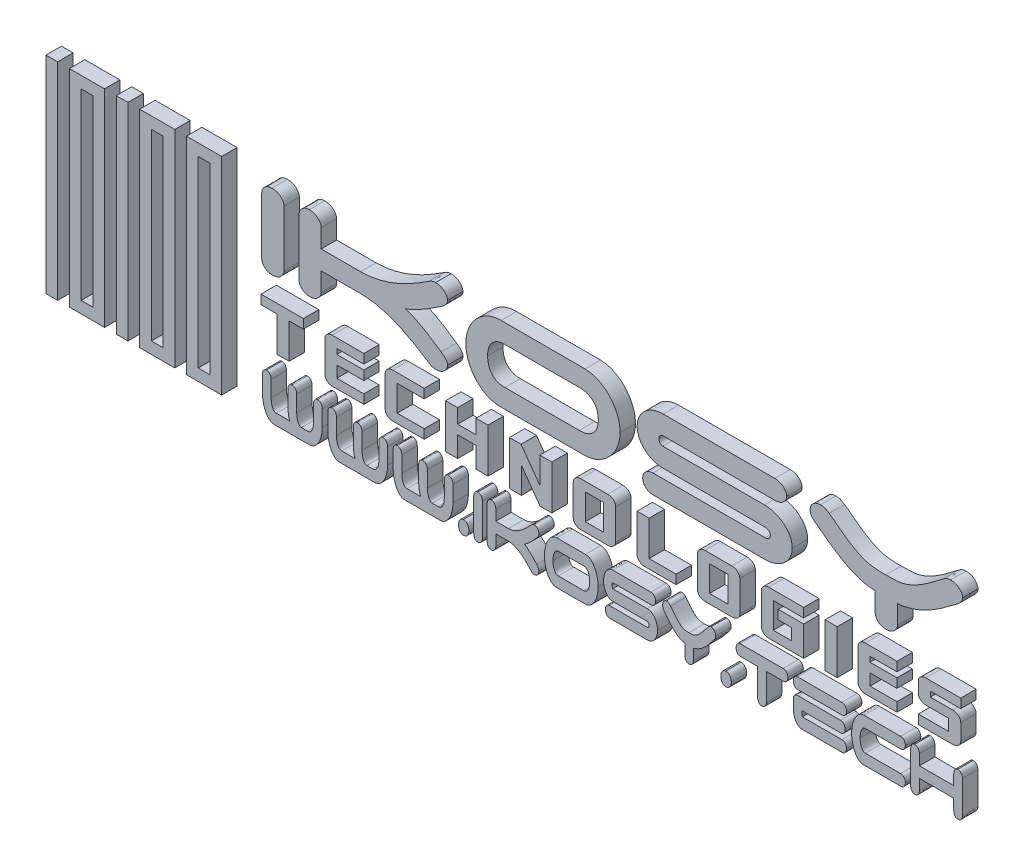
from build123d import *

# Parameters (mm, degrees)
SYMBOL_SKETCH_W        = 1.898333333
SYMBOL_SKETCH_H        = 33.5
SYMBOL_EXTRUDE_DEPTH   = 2.5
SYMBOL_SKETCH_W_2      = 5.695
SYMBOL_SKETCH_H_2      = 29.703333334
SYMBOL_EXTRUDE_2_DEPTH = 2.5
SYMBOL_EXTRUDE_3_DEPTH = 2.5
SYMBOL_EXTRUDE_4_DEPTH = 2.5
SYMBOL_SKETCH_W_3      = 1.898333334
SYMBOL_EXTRUDE_5_DEPTH = 2.5
TEXT_EXTRUDE_DEPTH     = 2.5
TEXT_EXTRUDE_2_DEPTH   = 2.5
TEXT_EXTRUDE_3_DEPTH   = 2.5
TEXT_EXTRUDE_4_DEPTH   = 2.5
TEXT_EXTRUDE_5_DEPTH   = 2.5
TEXT_EXTRUDE_6_DEPTH   = 2.5
TEXT_EXTRUDE_7_DEPTH   = 2.5
TEXT_EXTRUDE_8_DEPTH   = 2.5
TEXT_EXTRUDE_9_DEPTH   = 2.5
TEXT_EXTRUDE_10_DEPTH  = 2.5
TEXT_SKETCH_W          = 2.975584415
TEXT_SKETCH_H          = 4.184415584
TEXT_EXTRUDE_11_DEPTH  = 2.5
TEXT_EXTRUDE_12_DEPTH  = 2.5
TEXT_SKETCH_W_2        = 2.975584416
TEXT_EXTRUDE_13_DEPTH  = 2.5
TEXT_EXTRUDE_14_DEPTH  = 2.5
TEXT_SKETCH_W_3        = 1.952727273
TEXT_SKETCH_H_2        = 7.16
TEXT_EXTRUDE_15_DEPTH  = 2.5
TEXT_EXTRUDE_16_DEPTH  = 2.5
TEXT_EXTRUDE_17_DEPTH  = 2.5
TEXT_EXTRUDE_18_DEPTH  = 2.5
TEXT_EXTRUDE_19_DEPTH  = 2.5
TEXT_EXTRUDE_20_DEPTH  = 2.5
TEXT_EXTRUDE_21_DEPTH  = 2.5
TEXT_EXTRUDE_22_DEPTH  = 2.5
TEXT_EXTRUDE_23_DEPTH  = 2.5
TEXT_EXTRUDE_24_DEPTH  = 2.5
TEXT_EXTRUDE_25_DEPTH  = 2.5
TEXT_EXTRUDE_26_DEPTH  = 2.5
TEXT_EXTRUDE_27_DEPTH  = 2.5
TEXT_EXTRUDE_28_DEPTH  = 2.5
TEXT_EXTRUDE_29_DEPTH  = 2.5
TEXT_EXTRUDE_30_DEPTH  = 2.5
TEXT_EXTRUDE_31_DEPTH  = 2.5
TEXT_EXTRUDE_32_DEPTH  = 2.5


with BuildPart() as part:
    # Symbol Sketch → Symbol Extrude (new body)
    with BuildSketch(Plane.XY):
        with Locations((0.949166667, 20)):
            Rectangle(SYMBOL_SKETCH_W, SYMBOL_SKETCH_H)
    extrude(amount=SYMBOL_EXTRUDE_DEPTH)


with BuildPart() as body_2:
    # Symbol Sketch → Symbol Extrude 2 (new body)
    with BuildSketch(Plane.XY):
        with Locations((6.644166667, 20)):
            Rectangle(SYMBOL_SKETCH_W_2, SYMBOL_SKETCH_H)
        with Locations((6.644166667, 20)):
            Rectangle(SYMBOL_SKETCH_W, SYMBOL_SKETCH_H_2, mode=Mode.SUBTRACT)
    extrude(amount=SYMBOL_EXTRUDE_2_DEPTH)


with BuildPart() as body_3:
    # Symbol Sketch → Symbol Extrude 3 (new body)
    with BuildSketch(Plane.XY):
        with Locations((12.339166667, 20)):
            Rectangle(SYMBOL_SKETCH_W, SYMBOL_SKETCH_H)
    extrude(amount=SYMBOL_EXTRUDE_3_DEPTH)


with BuildPart() as body_4:
    # Symbol Sketch → Symbol Extrude 4 (new body)
    with BuildSketch(Plane.XY):
        with Locations((18.034166667, 20)):
            Rectangle(SYMBOL_SKETCH_W_2, SYMBOL_SKETCH_H)
        with Locations((18.034166666, 20)):
            Rectangle(SYMBOL_SKETCH_W, SYMBOL_SKETCH_H_2, mode=Mode.SUBTRACT)
    extrude(amount=SYMBOL_EXTRUDE_4_DEPTH)


with BuildPart() as body_5:
    # Symbol Sketch → Symbol Extrude 5 (new body)
    with BuildSketch(Plane.XY):
        with Locations((25.6275, 20)):
            Rectangle(SYMBOL_SKETCH_W_2, SYMBOL_SKETCH_H)
        with Locations((25.6275, 20)):
            Rectangle(SYMBOL_SKETCH_W_3, SYMBOL_SKETCH_H_2, mode=Mode.SUBTRACT)
    extrude(amount=SYMBOL_EXTRUDE_5_DEPTH)


with BuildPart() as body_6:
    # Text Sketch → Text Extrude (new body)
    with BuildSketch(Plane.XY):
        with BuildLine():
            add(Edge.make_bspline(
                [(38.58617952, 25.742968244), (38.578728998, 25.648724663), (38.563736149, 25.45907627), (38.458041001, 25.181383515), (38.28288778, 24.91940205), (38.049088279, 24.674897911), (37.761646275, 24.463275414), (37.424753642, 24.314535521), (37.04934564, 24.220213373), (36.785699087, 24.209354375), (36.648272845, 24.203694102)],
                knots=[0, 0, 0, 0, 0.827012487, 1.664215084, 2.574470293, 3.579806983, 4.622247116, 5.687620255, 6.794667886, 8, 8, 8, 8], degree=3))
            add(Edge.make_bspline(
                [(36.648272845, 24.203694102), (36.535881579, 24.208605962), (36.317042641, 24.218169928), (36.00220795, 24.30478626), (35.71318628, 24.44522547), (35.454426075, 24.637589779), (35.238243008, 24.870989489), (35.078686397, 25.137877741), (34.98513359, 25.432983763), (34.973059749, 25.638381569), (34.96691186, 25.742968244)],
                knots=[0, 0, 0, 0, 1.062246668, 2.068318494, 3.065407355, 4.089208683, 5.102960558, 6.057769713, 7.011034197, 8, 8, 8, 8], degree=3))
            Line((34.96691186, 25.742968244), (34.96691186, 34.844419961))
            add(Edge.make_bspline(
                [(34.96691186, 34.844419961), (34.972892619, 34.949054698), (34.984566439, 35.153290837), (35.079643542, 35.446575284), (35.238192539, 35.712392651), (35.45428519, 35.946190594), (35.714270537, 36.137273198), (36.002159686, 36.28442237), (36.318693483, 36.368075211), (36.537294973, 36.378434819), (36.648272845, 36.383694102)],
                knots=[0, 0, 0, 0, 0.989800277, 1.931987342, 2.88760215, 3.902209413, 4.926874609, 5.930317195, 6.949279836, 8, 8, 8, 8], degree=3))
            add(Edge.make_bspline(
                [(36.648272845, 36.383694102), (36.784386989, 36.377960599), (37.046722833, 36.366910288), (37.420658675, 36.27262537), (37.758943045, 36.124615418), (38.044456592, 35.908532932), (38.276990867, 35.663295025), (38.459654568, 35.406611891), (38.563383464, 35.128084263), (38.578611917, 34.938587962), (38.58617952, 34.844419961)],
                knots=[0, 0, 0, 0, 1.194994466, 2.303139656, 3.369569038, 4.419880172, 5.426213583, 6.334134964, 7.172167588, 8, 8, 8, 8], degree=3))
            Line((38.58617952, 34.844419961), (38.58617952, 25.742968244))
        make_face()
    extrude(amount=TEXT_EXTRUDE_DEPTH)


with BuildPart() as body_7:
    # Text Sketch → Text Extrude 2 (new body)
    with BuildSketch(Plane.XY):
        with BuildLine():
            Line((44.616976669, 31.832968244), (50.99904407, 31.832968244))
            add(Edge.make_bspline(
                [(50.99904407, 31.832968244), (51.250472845, 31.837805436), (51.752889352, 31.847471336), (52.502780268, 31.916787723), (53.247297761, 32.027242155), (53.985041027, 32.181291127), (54.714151514, 32.377721225), (55.436155905, 32.597170711), (56.14907894, 32.84795762), (57.088586543, 33.214538975), (58.235260737, 33.739869013), (59.555649172, 34.450158589), (60.805904401, 35.198038262), (61.609393709, 35.712138937), (61.998933895, 35.961380428)],
                knots=[0, 0, 0, 0, 0.759512858, 1.517693419, 2.273150063, 3.032382084, 3.793027637, 4.553662806, 5.311634984, 6.07554448, 7.599833594, 9.118344451, 10.602942657, 12, 12, 12, 12], degree=3))
            add(Edge.make_bspline(
                [(61.998933895, 35.961380428), (62.091741288, 36.026508577), (62.271019998, 36.152318495), (62.564405535, 36.282296471), (62.859901278, 36.36677829), (63.060090519, 36.378088468), (63.159309786, 36.383694102)],
                knots=[0, 0, 0, 0, 1.081283145, 2.088745753, 3.052730082, 4, 4, 4, 4], degree=3))
            add(Edge.make_bspline(
                [(63.159309786, 36.383694102), (63.29537401, 36.377848269), (63.557613644, 36.366581465), (63.932758387, 36.273678492), (64.269081584, 36.119866354), (64.555294314, 35.904662219), (64.788647169, 35.660588629), (64.96616679, 35.401409729), (65.07017152, 35.12551034), (65.085637784, 34.937294818), (65.093269605, 34.844419961)],
                knots=[0, 0, 0, 0, 1.19695264, 2.306913689, 3.379917877, 4.4319501, 5.439932537, 6.34289793, 7.182303793, 8, 8, 8, 8], degree=3))
            add(Edge.make_bspline(
                [(65.093269605, 34.844419961), (65.09082398, 34.780836992), (65.085888334, 34.652516758), (65.026618058, 34.467230724), (64.937873573, 34.2884461), (64.765838224, 34.056056074), (64.474187623, 33.777459887), (64.204080416, 33.585645094), (64.05919313, 33.482754375)],
                knots=[0, 0, 0, 0, 0.64067383, 1.292978567, 1.947314356, 2.652406948, 4.204329035, 6, 6, 6, 6], degree=3))
            add(Edge.make_bspline(
                [(64.05919313, 33.482754375), (63.811055998, 33.310970677), (63.33430852, 32.980921547), (62.625595115, 32.508335887), (61.919620661, 32.062611876), (61.185380456, 31.636695236), (60.420155651, 31.219111946), (59.768930321, 30.893903518), (59.262210171, 30.645346106), (58.904435319, 30.504117094), (58.581867311, 30.373810297), (58.369770187, 30.31679467), (58.269154245, 30.289747246)],
                knots=[0, 0, 0, 0, 1.364349134, 2.621332818, 3.850715262, 5.138077509, 6.458149398, 7.790756598, 8.429264738, 9.0080241, 9.529420355, 10, 10, 10, 10], degree=3))
            add(Edge.make_bspline(
                [(58.269154245, 30.289747246), (58.510553937, 30.211883788), (59.004957922, 30.052413808), (59.724000369, 29.711628823), (60.459365017, 29.344169962), (61.194165895, 28.943409954), (61.917180938, 28.527192215), (62.61873901, 28.076542915), (63.33290399, 27.603752779), (63.813712346, 27.272519802), (64.063139987, 27.100686973)],
                knots=[0, 0, 0, 0, 0.916305662, 1.876660108, 2.872423675, 3.89003152, 4.902700385, 5.888652335, 6.904701923, 8, 8, 8, 8], degree=3))
            add(Edge.make_bspline(
                [(64.063139987, 27.100686973), (64.205747996, 27.000678508), (64.474215908, 26.812406727), (64.759768772, 26.532862721), (64.939639104, 26.303494972), (65.0245807, 26.121896075), (65.086990612, 25.936524055), (65.091161172, 25.807962657), (65.093269605, 25.742968244)],
                knots=[0, 0, 0, 0, 1.763411785, 3.319725763, 4.034696239, 4.702841091, 5.344219315, 6, 6, 6, 6], degree=3))
            add(Edge.make_bspline(
                [(65.093269605, 25.742968244), (65.087854637, 25.648531241), (65.076922252, 25.457870494), (64.964116591, 25.184238033), (64.79382589, 24.921340102), (64.558652171, 24.679230591), (64.274901842, 24.463884753), (63.937521425, 24.313115374), (63.561544502, 24.220789432), (63.296695911, 24.209533134), (63.159309786, 24.203694102)],
                knots=[0, 0, 0, 0, 0.826234388, 1.668101081, 2.563017652, 3.569079421, 4.619107041, 5.674723332, 6.793798565, 8, 8, 8, 8], degree=3))
            add(Edge.make_bspline(
                [(63.159309786, 24.203694102), (63.060198357, 24.209701823), (62.860561964, 24.221802946), (62.56369981, 24.299838785), (62.272904601, 24.430926789), (62.094508499, 24.554595421), (62.002880752, 24.618114064)],
                knots=[0, 0, 0, 0, 0.952174275, 1.917928518, 2.930607123, 4, 4, 4, 4], degree=3))
            add(Edge.make_bspline(
                [(62.002880752, 24.618114064), (61.594030332, 24.882523336), (60.7700367, 25.415411517), (59.49855785, 26.170662744), (58.190520853, 26.884326157), (57.0563876, 27.398166375), (56.132167438, 27.769725819), (55.42284755, 28.013633096), (54.703010892, 28.231135157), (53.971872563, 28.415234971), (53.236022717, 28.574121553), (52.491780515, 28.676364444), (51.746449817, 28.749172798), (51.247873596, 28.755305905), (50.99904407, 28.758366818)],
                knots=[0, 0, 0, 0, 1.469175587, 2.960963885, 4.461900353, 5.963125577, 6.715099223, 7.467167186, 8.22579772, 8.983596741, 9.741977917, 10.496013332, 11.249390013, 12, 12, 12, 12], degree=3))
            Line((50.99904407, 28.758366818), (44.616976669, 28.758366818))
            Line((44.616976669, 28.758366818), (44.616976669, 25.742968244))
            add(Edge.make_bspline(
                [(44.616976669, 25.742968244), (44.609476248, 25.648756107), (44.594382988, 25.45917099), (44.489863895, 25.182028996), (44.312353271, 24.922862946), (44.079019178, 24.678735585), (43.796041015, 24.466243671), (43.465705435, 24.312740167), (43.099688381, 24.221521542), (42.84273472, 24.209746958), (42.710644848, 24.203694102)],
                knots=[0, 0, 0, 0, 0.836592577, 1.683493304, 2.59452107, 3.611503552, 4.672929131, 5.718792345, 6.827319959, 8, 8, 8, 8], degree=3))
            add(Edge.make_bspline(
                [(42.710644848, 24.203694102), (42.598253582, 24.208605962), (42.379414644, 24.218169928), (42.064579953, 24.30478626), (41.775558283, 24.44522547), (41.516798078, 24.637589779), (41.30061501, 24.870989489), (41.141058399, 25.137877741), (41.047505592, 25.432983763), (41.035431751, 25.638381569), (41.029283863, 25.742968244)],
                knots=[0, 0, 0, 0, 1.062246668, 2.068318494, 3.065407355, 4.089208683, 5.102960558, 6.057769713, 7.011034197, 8, 8, 8, 8], degree=3))
            Line((41.029283863, 25.742968244), (41.029283863, 34.844419961))
            add(Edge.make_bspline(
                [(41.029283863, 34.844419961), (41.035264945, 34.949054214), (41.046939397, 35.153289409), (41.142011915, 35.44658071), (41.300578752, 35.712371406), (41.516600261, 35.946275707), (41.77590274, 36.136257776), (42.058211156, 36.282815045), (42.365008021, 36.368310974), (42.575936565, 36.378514278), (42.68301685, 36.383694102)],
                knots=[0, 0, 0, 0, 1.000365375, 1.952609315, 2.918424327, 3.943861476, 4.979463917, 5.982364675, 6.97572438, 8, 8, 8, 8], degree=3))
            add(Edge.make_bspline(
                [(42.68301685, 36.383694102), (42.819081075, 36.377848269), (43.081320708, 36.366581465), (43.456465451, 36.273678492), (43.792788648, 36.119866354), (44.079001378, 35.904662219), (44.312354233, 35.660588629), (44.489873854, 35.401409729), (44.593878584, 35.12551034), (44.609344848, 34.937294818), (44.616976669, 34.844419961)],
                knots=[0, 0, 0, 0, 1.19695264, 2.306913689, 3.379917877, 4.4319501, 5.439932537, 6.34289793, 7.182303793, 8, 8, 8, 8], degree=3))
            Line((44.616976669, 34.844419961), (44.616976669, 31.832968244))
        make_face()
    extrude(amount=TEXT_EXTRUDE_2_DEPTH)


with BuildPart() as body_8:
    # Text Sketch → Text Extrude 3 (new body)
    with BuildSketch(Plane.XY):
        with BuildLine():
            add(Edge.make_bspline(
                [(93.076484122, 30.293694102), (93.07178162, 30.123749586), (93.062264045, 29.779792344), (92.98847156, 29.263253123), (92.868975479, 28.743356892), (92.704206799, 28.223861864), (92.490879244, 27.713345198), (92.235732809, 27.214133326), (91.918267894, 26.742720526), (91.5674964, 26.283039612), (91.162693527, 25.857560465), (90.714316583, 25.462231068), (90.214329207, 25.109961338), (89.676923687, 24.786950497), (89.090718648, 24.522918101), (88.458046801, 24.340884676), (87.785702706, 24.220308177), (87.322514644, 24.209323276), (87.085155541, 24.203694102)],
                knots=[0, 0, 0, 0, 0.861375316, 1.743370626, 2.639775799, 3.563725464, 4.502673277, 5.44242626, 6.400720383, 7.380024421, 8.370890464, 9.372963179, 10.405776481, 11.467352386, 12.548240692, 13.654153347, 14.797879085, 16, 16, 16, 16], degree=3))
            Line((87.085155541, 24.203694102), (73.48823396, 24.203694102))
            add(Edge.make_bspline(
                [(73.48823396, 24.203694102), (73.278339611, 24.218072224), (72.868156108, 24.246170495), (72.274251791, 24.378330558), (71.713931686, 24.563987208), (71.195622653, 24.825735388), (70.715906012, 25.133913889), (70.271081518, 25.479168487), (69.862853429, 25.859568025), (69.491572958, 26.274284232), (69.160197366, 26.719690361), (68.872801817, 27.19152362), (68.621029768, 27.682245744), (68.418189438, 28.194572239), (68.256021834, 28.716960074), (68.141629692, 29.242521398), (68.071936234, 29.768201537), (68.062218654, 30.118510144), (68.057359041, 30.293694102)],
                knots=[0, 0, 0, 0, 1.122378902, 2.193395442, 3.240157646, 4.267897263, 5.285543475, 6.28222577, 7.27174654, 8.262165333, 9.251686103, 10.232810863, 11.210279167, 12.194269119, 13.172368822, 14.129025321, 15.064354273, 16, 16, 16, 16], degree=3))
            add(Edge.make_bspline(
                [(68.057359041, 30.293694102), (68.062126406, 30.471501352), (68.071733554, 30.829816827), (68.143688904, 31.366735314), (68.269450617, 31.901384654), (68.432912732, 32.433202718), (68.644868394, 32.953338261), (68.90781737, 33.453366691), (69.215060781, 33.930595172), (69.568293712, 34.381865488), (69.961133605, 34.80410139), (70.396151465, 35.18729554), (70.870410409, 35.530157057), (71.382538976, 35.828443568), (71.930900934, 36.08451815), (72.522795808, 36.252196161), (73.145802312, 36.365368842), (73.573216822, 36.377487057), (73.792141931, 36.383694102)],
                knots=[0, 0, 0, 0, 0.920558032, 1.855099772, 2.798684957, 3.761813886, 4.733362122, 5.702327594, 6.683027567, 7.668259754, 8.665942401, 9.665019498, 10.665210756, 11.691033013, 12.730650648, 13.789003633, 14.867510086, 16, 16, 16, 16], degree=3))
            Line((73.792141931, 36.383694102), (87.393010369, 36.379747246))
            add(Edge.make_bspline(
                [(87.393010369, 36.379747246), (87.623883289, 36.362565832), (88.073396991, 36.329113313), (88.721947871, 36.193593452), (89.324045495, 35.987937387), (89.876296625, 35.711991776), (90.385453756, 35.391303723), (90.852172982, 35.036376428), (91.274696095, 34.647236323), (91.64786969, 34.224032259), (91.980488961, 33.777632531), (92.269886433, 33.308323901), (92.520415871, 32.820017425), (92.718456897, 32.312061118), (92.875786481, 31.801241052), (92.992528298, 31.29380564), (93.061241525, 30.791574524), (93.071443386, 30.458343463), (93.076484122, 30.293694102)],
                knots=[0, 0, 0, 0, 1.210395071, 2.356660839, 3.456077234, 4.530554179, 5.579159981, 6.600799407, 7.594598058, 8.579631317, 9.548926699, 10.504136457, 11.46162572, 12.416562565, 13.352906517, 14.256408605, 15.138492049, 16, 16, 16, 16], degree=3))
        make_face()
        with BuildLine():
            add(Edge.make_bspline(
                [(86.461552171, 27.278295528), (86.614349132, 27.282015379), (86.905243894, 27.289097229), (87.319647476, 27.343838968), (87.689701798, 27.435410044), (88.013969479, 27.573156791), (88.297736916, 27.737330357), (88.553865548, 27.912745249), (88.770584762, 28.112489333), (88.959152865, 28.323528936), (89.118427761, 28.549935409), (89.247160963, 28.790617797), (89.353273639, 29.04242132), (89.445400073, 29.38730446), (89.526570129, 29.804562521), (89.54112009, 30.136752244), (89.547994167, 30.293694102)],
                knots=[0, 0, 0, 0, 1.310435419, 2.494806159, 3.57882731, 4.570295576, 5.505431711, 6.388441988, 7.2273623, 8.02686493, 8.812789128, 9.595546392, 10.364760831, 11.150766064, 12.653889518, 14, 14, 14, 14], degree=3))
            add(Edge.make_bspline(
                [(89.547994167, 30.293694102), (89.541105298, 30.44931472), (89.52651642, 30.778879695), (89.445346708, 31.193586635), (89.35227564, 31.537954536), (89.24922311, 31.791161138), (89.117286768, 32.030349534), (88.957906273, 32.256079947), (88.771929647, 32.472273774), (88.549839305, 32.669224138), (88.293985313, 32.846196615), (88.009166896, 33.011607124), (87.683223011, 33.145262812), (87.315351269, 33.245781435), (86.902435526, 33.297502715), (86.612972946, 33.30511212), (86.461552171, 33.309092677)],
                knots=[0, 0, 0, 0, 1.336170635, 2.829670299, 3.616453323, 4.396883994, 5.170497828, 5.957199736, 6.765980933, 7.614124952, 8.49800901, 9.434070507, 10.436946465, 11.514012084, 12.699554817, 14, 14, 14, 14], degree=3))
            Line((86.461552171, 33.309092677), (74.419692158, 33.309092677))
            add(Edge.make_bspline(
                [(74.419692158, 33.309092677), (74.282703874, 33.3066055), (74.020813139, 33.301850579), (73.649739418, 33.251652217), (73.321857329, 33.165769198), (73.036101032, 33.044991192), (72.7858579, 32.897556185), (72.562497353, 32.727493612), (72.356026253, 32.545272867), (72.178901479, 32.337301223), (72.022571049, 32.11479863), (71.893383033, 31.874846524), (71.788811279, 31.618062894), (71.689588071, 31.262703803), (71.605430024, 30.81983156), (71.592228789, 30.465117593), (71.585848995, 30.293694102)],
                knots=[0, 0, 0, 0, 1.223512881, 2.339080959, 3.337152355, 4.243268766, 5.10217055, 5.925080399, 6.74908114, 7.557504542, 8.359750133, 9.175067622, 9.987158136, 10.831699936, 12.468847838, 14, 14, 14, 14], degree=3))
            add(Edge.make_bspline(
                [(71.585848995, 30.293694102), (71.592390947, 30.123609641), (71.606031538, 29.768967321), (71.689106554, 29.325892626), (71.788885353, 28.969368093), (71.893175064, 28.712395818), (72.023848822, 28.472178617), (72.177377293, 28.246328334), (72.356210028, 28.039744982), (72.558517596, 27.854453464), (72.78152532, 27.687281454), (73.028848277, 27.53751783), (73.313482778, 27.416825734), (73.642529656, 27.337134723), (74.01542863, 27.284759221), (74.280030694, 27.280528549), (74.419692158, 27.278295528)],
                knots=[0, 0, 0, 0, 1.518201798, 3.165595501, 4.009460921, 4.820901045, 5.63556556, 6.446835624, 7.254611573, 8.069276088, 8.891526881, 9.739632858, 10.645023576, 11.639316523, 12.753991161, 14, 14, 14, 14], degree=3))
            Line((74.419692158, 27.278295528), (86.461552171, 27.278295528))
        make_face(mode=Mode.SUBTRACT)
    extrude(amount=TEXT_EXTRUDE_3_DEPTH)


with BuildPart() as body_9:
    # Text Sketch → Text Extrude 4 (new body)
    with BuildSketch(Plane.XY):
        with BuildLine():
            add(Edge.make_bspline(
                [(100.058473752, 28.758366818), (99.913576142, 28.762324842), (99.627982626, 28.770126117), (99.207898465, 28.826932835), (98.803598987, 28.917458717), (98.415854147, 29.043199142), (98.049574874, 29.205741327), (97.705813118, 29.3959745), (97.381733031, 29.610057163), (97.08398153, 29.854335592), (96.809733165, 30.122142072), (96.569402413, 30.416700982), (96.354960566, 30.728565154), (96.171166675, 31.061973216), (96.026726244, 31.41583334), (95.91775477, 31.786891262), (95.853667755, 32.174101356), (95.8467308, 32.437919492), (95.843230719, 32.57103046)],
                knots=[0, 0, 0, 0, 1.101185052, 2.170438211, 3.216094871, 4.247062922, 5.263474479, 6.257148653, 7.230691061, 8.211550939, 9.180356387, 10.139409208, 11.096374179, 12.054122627, 13.027254041, 13.995698119, 14.988717881, 16, 16, 16, 16], degree=3))
            add(Edge.make_bspline(
                [(95.843230719, 32.57103046), (95.846528608, 32.704177299), (95.853000474, 32.965468296), (95.919021404, 33.349635933), (96.025585079, 33.717486092), (96.17327739, 34.069885678), (96.353805709, 34.404839761), (96.56826816, 34.717163158), (96.81115506, 35.008158071), (97.083603486, 35.276341084), (97.383111741, 35.519432688), (97.705146259, 35.740022504), (98.052954293, 35.927172888), (98.421389466, 36.091344669), (98.810226, 36.219814026), (99.213990278, 36.315828886), (99.631966855, 36.371701398), (99.91490774, 36.379657252), (100.058473752, 36.383694102)],
                knots=[0, 0, 0, 0, 1.012456936, 1.98687317, 2.956442301, 3.921451654, 4.889106224, 5.847182912, 6.799645564, 7.769576484, 8.751575838, 9.731838313, 10.735444845, 11.753037179, 12.797847865, 13.846967067, 14.907537332, 16, 16, 16, 16], degree=3))
            Line((100.058473752, 36.383694102), (118.150865198, 36.383694102))
            add(Edge.make_bspline(
                [(118.150865198, 36.383694102), (118.286979341, 36.377960599), (118.549315186, 36.366910288), (118.923251028, 36.27262537), (119.261535397, 36.124615418), (119.547048945, 35.908532932), (119.77958322, 35.663295025), (119.962246921, 35.406611891), (120.065975816, 35.128084263), (120.081204269, 34.938587962), (120.088771873, 34.844419961)],
                knots=[0, 0, 0, 0, 1.194994466, 2.303139656, 3.369569038, 4.419880172, 5.426213583, 6.334134964, 7.172167588, 8, 8, 8, 8], degree=3))
            add(Edge.make_bspline(
                [(120.088771873, 34.844419961), (120.081269154, 34.750210372), (120.066171271, 34.560630383), (119.961688069, 34.283448587), (119.784024831, 34.024451776), (119.551882315, 33.780165405), (119.264182519, 33.568710455), (118.927361711, 33.41992388), (118.551933586, 33.325614812), (118.288289929, 33.314753931), (118.150865198, 33.309092677)],
                knots=[0, 0, 0, 0, 0.828012303, 1.666227035, 2.567911104, 3.574463195, 4.618163585, 5.684824706, 6.793210701, 8, 8, 8, 8], degree=3))
            Line((118.150865198, 33.309092677), (99.999270901, 33.309092677))
            add(Edge.make_bspline(
                [(99.999270901, 33.309092677), (99.930601339, 33.299160364), (99.777942451, 33.277079898), (99.609148607, 33.160426143), (99.482980914, 33.033282629), (99.421607345, 32.897689249), (99.37488145, 32.743908712), (99.372811166, 32.630674798), (99.371720674, 32.57103046)],
                knots=[0, 0, 0, 0, 1.147633353, 2.551296784, 3.329622295, 4.116603003, 5.007947684, 6, 6, 6, 6], degree=3))
            add(Edge.make_bspline(
                [(99.371720674, 32.57103046), (99.372503684, 32.512587037), (99.373972024, 32.402990864), (99.424270413, 32.253264259), (99.481487208, 32.117194209), (99.610276726, 31.989520432), (99.777213995, 31.869407598), (99.930485044, 31.844255946), (99.999270901, 31.832968244)],
                knots=[0, 0, 0, 0, 0.974619328, 1.827657275, 2.638126184, 3.420073298, 4.842165753, 6, 6, 6, 6], degree=3))
            Line((99.999270901, 31.832968244), (116.481344783, 31.832968244))
            add(Edge.make_bspline(
                [(116.481344783, 31.832968244), (116.640780337, 31.829742661), (116.954378743, 31.823398168), (117.416392454, 31.756113512), (117.862228641, 31.655944194), (118.288686175, 31.51127769), (118.693525567, 31.340275681), (119.070640789, 31.137039785), (119.419291776, 30.910389985), (119.730800013, 30.651294626), (120.012613948, 30.374507223), (120.263090959, 30.07847485), (120.476614479, 29.759753337), (120.658731041, 29.426402203), (120.800202374, 29.079066559), (120.904321008, 28.723625355), (120.970250175, 28.360875761), (120.977260818, 28.115301416), (120.980761504, 27.992676604)],
                knots=[0, 0, 0, 0, 1.166797552, 2.29500788, 3.412179957, 4.509017153, 5.588150223, 6.627004969, 7.642452773, 8.628119358, 9.588746174, 10.53245828, 11.462397167, 12.393582989, 13.309642914, 14.20297541, 15.102675805, 16, 16, 16, 16], degree=3))
            add(Edge.make_bspline(
                [(120.980761504, 27.992676604), (120.97729269, 27.870039216), (120.970345877, 27.624439683), (120.903938151, 27.261878928), (120.801837612, 26.906399973), (120.654684302, 26.56456085), (120.471878218, 26.236476438), (120.258066876, 25.922046223), (120.007234825, 25.625548168), (119.725349778, 25.345523347), (119.407914854, 25.093364045), (119.063050491, 24.86752001), (118.689270328, 24.669243348), (118.288308644, 24.499877737), (117.862851568, 24.366122421), (117.417594927, 24.271089523), (116.95505446, 24.215772292), (116.640681532, 24.207756716), (116.481344783, 24.203694102)],
                knots=[0, 0, 0, 0, 0.901067102, 1.804520316, 2.701579069, 3.616255735, 4.534354247, 5.460168862, 6.407817367, 7.386133202, 8.377328735, 9.383613537, 10.413708689, 11.484657324, 12.580104494, 13.688294789, 14.828335517, 16, 16, 16, 16], degree=3))
            Line((116.481344783, 24.203694102), (98.420528192, 24.203694102))
            add(Edge.make_bspline(
                [(98.420528192, 24.203694102), (98.3081099, 24.208549459), (98.089218337, 24.218003407), (97.773610651, 24.305728962), (97.482206996, 24.443999338), (97.222799821, 24.637727456), (97.006535216, 24.870955137), (96.846999105, 25.137886642), (96.75344098, 25.432981442), (96.741367868, 25.638380786), (96.73522035, 25.742968244)],
                knots=[0, 0, 0, 0, 1.060759457, 2.065422719, 3.072316092, 4.094684034, 5.107016593, 6.060488956, 7.012418811, 8, 8, 8, 8], degree=3))
            add(Edge.make_bspline(
                [(96.73522035, 25.742968244), (96.740762823, 25.847757746), (96.751602811, 26.052705441), (96.853194867, 26.344158101), (97.008833191, 26.610931755), (97.228195463, 26.840536179), (97.486989835, 27.033356281), (97.776509998, 27.177182335), (98.092016539, 27.263345222), (98.309481305, 27.273241872), (98.420528192, 27.278295528)],
                knots=[0, 0, 0, 0, 0.990563403, 1.937347544, 2.893699121, 3.899927966, 4.925383168, 5.940772683, 6.948469742, 8, 8, 8, 8], degree=3))
            Line((98.420528192, 27.278295528), (116.599750486, 27.278295528))
            add(Edge.make_bspline(
                [(116.599750486, 27.278295528), (116.658055538, 27.279520168), (116.771205561, 27.281896773), (116.929544516, 27.330281335), (117.078528833, 27.39146458), (117.203966391, 27.488502551), (117.317146836, 27.594053621), (117.391696435, 27.721129111), (117.443639251, 27.853222753), (117.449391016, 27.946141909), (117.452271549, 27.992676604)],
                knots=[0, 0, 0, 0, 1.130512265, 2.193934927, 3.203795308, 4.249773415, 5.264825915, 6.19685873, 7.096971688, 8, 8, 8, 8], degree=3))
            add(Edge.make_bspline(
                [(117.452271549, 27.992676604), (117.449211575, 28.043008029), (117.443112658, 28.143324955), (117.394736827, 28.287326452), (117.31126589, 28.417419958), (117.202446708, 28.533428735), (117.072229, 28.630432591), (116.929584513, 28.71069832), (116.767230343, 28.747293289), (116.656432247, 28.754619101), (116.599750486, 28.758366818)],
                knots=[0, 0, 0, 0, 0.950930182, 1.895324684, 2.834457895, 3.85573418, 4.886067188, 5.8991232, 6.925239685, 8, 8, 8, 8], degree=3))
            Line((116.599750486, 28.758366818), (100.058473752, 28.758366818))
        make_face()
    extrude(amount=TEXT_EXTRUDE_4_DEPTH)


with BuildPart() as body_10:
    # Text Sketch → Text Extrude 5 (new body)
    with BuildSketch(Plane.XY):
        with BuildLine():
            add(Edge.make_bspline(
                [(138.050917045, 25.742968244), (138.045502077, 25.648531241), (138.034569692, 25.457870494), (137.921764031, 25.184238033), (137.75147333, 24.921340102), (137.516299611, 24.679230591), (137.232549282, 24.463884753), (136.895168865, 24.313115374), (136.519191942, 24.220789432), (136.254343351, 24.209533134), (136.116957226, 24.203694102)],
                knots=[0, 0, 0, 0, 0.826234388, 1.668101081, 2.563017652, 3.569079421, 4.619107041, 5.674723332, 6.793798565, 8, 8, 8, 8], degree=3))
            add(Edge.make_bspline(
                [(136.116957226, 24.203694102), (136.004602938, 24.208753547), (135.784563394, 24.218662184), (135.468026187, 24.303957011), (135.177942442, 24.445299635), (134.919158595, 24.637569865), (134.702981781, 24.870994458), (134.543423597, 25.137876454), (134.449871198, 25.432984099), (134.437797302, 25.638381683), (134.431649384, 25.742968244)],
                knots=[0, 0, 0, 0, 1.060651481, 2.077226164, 3.072817686, 4.095081561, 5.107311074, 6.060686381, 7.012519338, 8, 8, 8, 8], degree=3))
            Line((134.431649384, 25.742968244), (134.431649384, 28.758366818))
            add(Edge.make_bspline(
                [(134.431649384, 28.758366818), (134.273630752, 28.761190505), (133.950213462, 28.766969756), (133.454980703, 28.823063978), (132.938063896, 28.904357449), (132.403218745, 29.023810113), (131.851137079, 29.17669607), (131.290912094, 29.377142772), (130.713268128, 29.605084197), (130.126138624, 29.880142999), (129.517480967, 30.194114202), (128.887769636, 30.553885393), (128.232009415, 30.95829065), (127.548111385, 31.404510006), (126.838657543, 31.89851157), (126.101347018, 32.438772718), (125.32551342, 33.011375041), (124.806814149, 33.419501653), (124.540826312, 33.628788075)],
                knots=[0, 0, 0, 0, 0.675563101, 1.38267737, 2.129168312, 2.912777684, 3.725071655, 4.577436279, 5.456136086, 6.380024639, 7.348873164, 8.384543755, 9.480786257, 10.643431717, 11.876471874, 13.177474939, 14.552615405, 16, 16, 16, 16], degree=3))
            add(Edge.make_bspline(
                [(124.540826312, 33.628788075), (124.45366168, 33.706285659), (124.276977974, 33.863374146), (124.065069591, 34.152272428), (123.907341196, 34.482732767), (123.890216895, 34.724294742), (123.881701231, 34.844419961)],
                knots=[0, 0, 0, 0, 0.97748796, 1.981379261, 2.99616958, 4, 4, 4, 4], degree=3))
            add(Edge.make_bspline(
                [(123.881701231, 34.844419961), (123.88768199, 34.949054698), (123.89935581, 35.153290837), (123.994432913, 35.446575284), (124.15298191, 35.712392651), (124.369074561, 35.946190594), (124.629059908, 36.137273198), (124.916949057, 36.28442237), (125.233482854, 36.368075211), (125.452084344, 36.378434819), (125.563062216, 36.383694102)],
                knots=[0, 0, 0, 0, 0.989800277, 1.931987342, 2.88760215, 3.902209413, 4.926874609, 5.930317195, 6.949279836, 8, 8, 8, 8], degree=3))
            add(Edge.make_bspline(
                [(125.563062216, 36.383694102), (125.700799254, 36.379800273), (125.951359311, 36.372716934), (126.302144317, 36.266806726), (126.624476112, 36.098878452), (126.838721624, 35.969329213), (126.956302657, 35.898230719)],
                knots=[0, 0, 0, 0, 1.097798724, 1.99702648, 2.900739191, 4, 4, 4, 4], degree=3))
            add(Edge.make_bspline(
                [(126.956302657, 35.898230719), (127.113756812, 35.774017074), (127.4207871, 35.531804657), (127.876334572, 35.187042126), (128.30320062, 34.855825008), (128.717720142, 34.560932634), (129.097102608, 34.270495322), (129.466342802, 34.017949417), (129.807976894, 33.779935702), (130.227115473, 33.499845246), (130.723282454, 33.193448068), (131.290034635, 32.866998857), (131.82421043, 32.598205413), (132.3250977, 32.376203941), (132.803972936, 32.206976225), (133.262734153, 32.068705586), (133.708396217, 31.976844623), (134.147008654, 31.909058928), (134.597226799, 31.879327582), (135.077256527, 31.849207664), (135.597197901, 31.834366221), (135.957762407, 31.833445372), (136.144585224, 31.832968244)],
                knots=[0, 0, 0, 0, 1.165628064, 2.272935384, 3.320573878, 4.305556754, 5.229300694, 6.096933698, 6.905073425, 7.649487801, 9.026632476, 10.293786997, 11.449667425, 12.500955413, 13.475704036, 14.400049135, 15.283410906, 16.118278182, 16.977479639, 17.904288567, 18.914128526, 20, 20, 20, 20], degree=3))
            add(Edge.make_bspline(
                [(136.144585224, 31.832968244), (136.335361716, 31.833310918), (136.702516338, 31.833970405), (137.231502483, 31.85050234), (137.718252267, 31.875017955), (138.174788147, 31.901871317), (138.61932782, 31.963427603), (139.072657165, 32.057582533), (139.542234864, 32.199072995), (140.035152684, 32.376334775), (140.552573178, 32.607150555), (141.104157006, 32.880698908), (141.685978201, 33.217935706), (142.192929062, 33.533817817), (142.62306719, 33.819676438), (142.972291094, 34.058375219), (143.341506667, 34.322748794), (143.735226666, 34.602890052), (144.144867541, 34.914158095), (144.578914934, 35.24012986), (145.033840639, 35.587476555), (145.341076299, 35.829414054), (145.498635774, 35.953486714)],
                knots=[0, 0, 0, 0, 1.089600888, 2.096966969, 3.022326123, 3.873568461, 4.707792273, 5.583201347, 6.515278757, 7.50651283, 8.57314792, 9.749323506, 11.021551922, 12.412267841, 13.160460729, 13.971240521, 14.828168449, 15.754107106, 16.73096743, 17.766443736, 18.854566706, 20, 20, 20, 20], degree=3))
            add(Edge.make_bspline(
                [(145.498635774, 35.953486714), (145.594174583, 36.019715176), (145.777922267, 36.147090916), (146.073973335, 36.28242049), (146.370241648, 36.366251959), (146.569037759, 36.377940042), (146.666905379, 36.383694102)],
                knots=[0, 0, 0, 0, 1.100398394, 2.116371958, 3.072687123, 4, 4, 4, 4], degree=3))
            add(Edge.make_bspline(
                [(146.666905379, 36.383694102), (146.802969603, 36.377848269), (147.065209237, 36.366581465), (147.44035398, 36.273678492), (147.776677177, 36.119866354), (148.062889907, 35.904662219), (148.296242762, 35.660588629), (148.473762383, 35.401409729), (148.577767113, 35.12551034), (148.593233377, 34.937294818), (148.600865198, 34.844419961)],
                knots=[0, 0, 0, 0, 1.19695264, 2.306913689, 3.379917877, 4.4319501, 5.439932537, 6.34289793, 7.182303793, 8, 8, 8, 8], degree=3))
            add(Edge.make_bspline(
                [(148.600865198, 34.844419961), (148.59067663, 34.743002369), (148.569287836, 34.53009709), (148.41574659, 34.217916382), (148.174198536, 33.905527939), (147.956589618, 33.72580472), (147.839121841, 33.628788075)],
                knots=[0, 0, 0, 0, 0.819913554, 1.7212391, 2.769898859, 4, 4, 4, 4], degree=3))
            add(Edge.make_bspline(
                [(147.839121841, 33.628788075), (147.583554362, 33.428842788), (147.082809002, 33.0370806), (146.330240994, 32.483041912), (145.606805288, 31.956707989), (144.90265218, 31.469305858), (144.217166409, 31.021830784), (143.542927047, 30.619031981), (142.88672864, 30.250662673), (142.241047623, 29.926234536), (141.612057444, 29.641949685), (140.996977374, 29.399397855), (140.397623441, 29.197532679), (139.82116886, 29.038371947), (139.288306709, 28.917893096), (138.815584137, 28.831157224), (138.411741537, 28.768539627), (138.162920243, 28.76152455), (138.050917045, 28.758366818)],
                knots=[0, 0, 0, 0, 1.403088018, 2.749136222, 4.040752647, 5.271654779, 6.45197988, 7.579848887, 8.667307338, 9.705353704, 10.703519795, 11.651153454, 12.563267389, 13.436959124, 14.23606409, 14.924534018, 15.515895008, 16, 16, 16, 16], degree=3))
            Line((138.050917045, 28.758366818), (138.050917045, 25.742968244))
        make_face()
    extrude(amount=TEXT_EXTRUDE_5_DEPTH)


with BuildPart() as body_11:
    # Text Sketch → Text Extrude 6 (new body)
    with BuildSketch(Plane.XY):
        Polygon((41.72773539, 19.129220779), (39.410324675, 19.129220779), (39.410324675, 13.457012987), (37.457597403, 13.457012987), (37.457597403, 19.129220779), (34.853961039, 19.129220779), (34.853961039, 20.617012987), (41.72773539, 20.617012987), align=None)
    extrude(amount=TEXT_EXTRUDE_6_DEPTH)


with BuildPart() as body_12:
    # Text Sketch → Text Extrude 7 (new body)
    with BuildSketch(Plane.XY):
        with BuildLine():
            Line((51.526125649, 13.457012987), (46.39440487, 13.457012987))
            add(Edge.make_bspline(
                [(46.39440487, 13.457012987), (46.354142938, 13.45756046), (46.274734761, 13.458640236), (46.158683043, 13.475823286), (46.046743345, 13.500259996), (45.939065668, 13.535039191), (45.835920023, 13.580712168), (45.735767814, 13.634123277), (45.64191221, 13.70037824), (45.552233624, 13.773845408), (45.469470164, 13.854163146), (45.398635992, 13.941485884), (45.338210126, 14.032457637), (45.288590862, 14.127426095), (45.249134512, 14.22612313), (45.22102559, 14.329402479), (45.205267297, 14.436761547), (45.202800036, 14.509848301), (45.201555844, 14.546704545)],
                knots=[0, 0, 0, 0, 1.075676963, 2.121546162, 3.130184974, 4.137742224, 5.141128759, 6.143762722, 7.167669179, 8.207425894, 9.242331462, 10.245634405, 11.208324302, 12.158385911, 13.105972476, 14.045380843, 15.014323166, 16, 16, 16, 16], degree=3))
            Line((45.201555844, 14.546704545), (45.201555844, 19.527321429))
            add(Edge.make_bspline(
                [(45.201555844, 19.527321429), (45.202757769, 19.564184739), (45.205125594, 19.636806467), (45.221412193, 19.744058016), (45.248890471, 19.84746847), (45.288236213, 19.94631231), (45.338643083, 20.040372017), (45.398601903, 20.131088375), (45.469395394, 20.218517926), (45.552804098, 20.298493463), (45.640873742, 20.374092361), (45.73673736, 20.437865048), (45.835402508, 20.493740942), (45.939152895, 20.538818898), (46.047148674, 20.574062106), (46.159239618, 20.597838751), (46.275194892, 20.615514909), (46.354136162, 20.616506942), (46.39440487, 20.617012987)],
                knots=[0, 0, 0, 0, 0.985968526, 1.942384951, 2.89458032, 3.842447305, 4.781329565, 5.744304352, 6.747904203, 7.783116032, 8.831458333, 9.848349276, 10.857536075, 11.861219542, 12.86907496, 13.890659081, 14.924004711, 16, 16, 16, 16], degree=3))
            Line((46.39440487, 20.617012987), (51.526125649, 20.617012987))
            Line((51.526125649, 20.617012987), (51.526125649, 19.129220779))
            Line((51.526125649, 19.129220779), (47.154283117, 19.129220779))
            Line((47.154283117, 19.129220779), (47.154283117, 18.292337662))
            Line((47.154283117, 18.292337662), (51.526125649, 18.292337662))
            Line((51.526125649, 18.292337662), (51.526125649, 16.804545455))
            Line((51.526125649, 16.804545455), (47.154283117, 16.804545455))
            Line((47.154283117, 16.804545455), (47.154283117, 14.944805195))
            Line((47.154283117, 14.944805195), (51.526125649, 14.944805195))
            Line((51.526125649, 14.944805195), (51.526125649, 13.457012987))
        make_face()
    extrude(amount=TEXT_EXTRUDE_7_DEPTH)


with BuildPart() as body_13:
    # Text Sketch → Text Extrude 8 (new body)
    with BuildSketch(Plane.XY):
        with BuildLine():
            Line((61.315798377, 13.457012987), (56.184077597, 13.457012987))
            add(Edge.make_bspline(
                [(56.184077597, 13.457012987), (56.143815666, 13.45756046), (56.064407488, 13.458640236), (55.948355771, 13.475823286), (55.836416072, 13.500259996), (55.728738395, 13.535039191), (55.62559275, 13.580712168), (55.525440541, 13.634123277), (55.431584937, 13.70037824), (55.341906351, 13.773845408), (55.259142891, 13.854163146), (55.188308719, 13.941485884), (55.127882853, 14.032457637), (55.078263589, 14.127426095), (55.038807239, 14.22612313), (55.010698317, 14.329402479), (54.994940025, 14.436761547), (54.992472764, 14.509848301), (54.991228571, 14.546704545)],
                knots=[0, 0, 0, 0, 1.075676963, 2.121546162, 3.130184974, 4.137742224, 5.141128759, 6.143762722, 7.167669179, 8.207425894, 9.242331462, 10.245634405, 11.208324302, 12.158385911, 13.105972476, 14.045380843, 15.014323166, 16, 16, 16, 16], degree=3))
            Line((54.991228571, 14.546704545), (54.991228571, 19.527321429))
            add(Edge.make_bspline(
                [(54.991228571, 19.527321429), (54.992430496, 19.564184739), (54.994798321, 19.636806467), (55.011084921, 19.744058016), (55.038563198, 19.84746847), (55.07790894, 19.94631231), (55.12831581, 20.040372017), (55.18827463, 20.131088375), (55.259068121, 20.218517926), (55.342476826, 20.298493463), (55.430546469, 20.374092361), (55.526410088, 20.437865048), (55.625075236, 20.493740942), (55.728825622, 20.538818898), (55.836821401, 20.574062106), (55.948912345, 20.597838751), (56.064867619, 20.615514909), (56.143808889, 20.616506942), (56.184077597, 20.617012987)],
                knots=[0, 0, 0, 0, 0.985968526, 1.942384951, 2.89458032, 3.842447305, 4.781329565, 5.744304352, 6.747904203, 7.783116032, 8.831458333, 9.848349276, 10.857536075, 11.861219542, 12.86907496, 13.890659081, 14.924004711, 16, 16, 16, 16], degree=3))
            Line((56.184077597, 20.617012987), (61.315798377, 20.617012987))
            Line((61.315798377, 20.617012987), (61.315798377, 19.129220779))
            Line((61.315798377, 19.129220779), (56.943955844, 19.129220779))
            Line((56.943955844, 19.129220779), (56.943955844, 14.944805195))
            Line((56.943955844, 14.944805195), (61.315798377, 14.944805195))
            Line((61.315798377, 14.944805195), (61.315798377, 13.457012987))
        make_face()
    extrude(amount=TEXT_EXTRUDE_8_DEPTH)


with BuildPart() as body_14:
    # Text Sketch → Text Extrude 9 (new body)
    with BuildSketch(Plane.XY):
        Polygon((71.66194026, 13.457012987), (69.709212987, 13.457012987), (69.709212987, 16.804545455), (66.733628571, 16.804545455), (66.733628571, 13.457012987), (64.780901299, 13.457012987), (64.780901299, 20.617012987), (66.733628571, 20.617012987), (66.733628571, 18.292337662), (69.709212987, 18.292337662), (69.709212987, 20.617012987), (71.66194026, 20.617012987), align=None)
    extrude(amount=TEXT_EXTRUDE_9_DEPTH)


with BuildPart() as body_15:
    # Text Sketch → Text Extrude 10 (new body)
    with BuildSketch(Plane.XY):
        Polygon((82.009535065, 13.457012987), (80.101848377, 13.457012987), (77.081223377, 17.689375), (77.081223377, 13.457012987), (75.128496104, 13.457012987), (75.128496104, 20.617012987), (77.015841883, 20.617012987), (80.074242857, 16.364310065), (80.056807792, 20.617012987), (82.009535065, 20.617012987), align=None)
    extrude(amount=TEXT_EXTRUDE_10_DEPTH)


with BuildPart() as body_16:
    # Text Sketch → Text Extrude 11 (new body)
    with BuildSketch(Plane.XY):
        with BuildLine():
            add(Edge.make_bspline(
                [(92.35712987, 14.546704545), (92.356016001, 14.512244233), (92.353789694, 14.443367929), (92.335664694, 14.341481861), (92.30698081, 14.242318897), (92.264812379, 14.14634031), (92.213073279, 14.052769824), (92.149955877, 13.961176907), (92.073201055, 13.874286759), (91.987639396, 13.78985512), (91.893589098, 13.711033245), (91.792179701, 13.643069376), (91.685349808, 13.58615138), (91.573406921, 13.539285984), (91.456056915, 13.50110196), (91.332328057, 13.475200555), (91.203359352, 13.460951691), (91.115883909, 13.458342836), (91.071293831, 13.457012987)],
                knots=[0, 0, 0, 0, 0.886314192, 1.77148843, 2.65490602, 3.537003827, 4.463087229, 5.403485493, 6.393061892, 7.441851859, 8.49507585, 9.545937357, 10.5774784, 11.6052478, 12.665527663, 13.748421643, 14.852271535, 16, 16, 16, 16], degree=3))
            Line((91.071293831, 13.457012987), (86.668939935, 13.457012987))
            add(Edge.make_bspline(
                [(86.668939935, 13.457012987), (86.629163085, 13.457580134), (86.550240615, 13.458705428), (86.434677262, 13.475834393), (86.322709494, 13.500222726), (86.21513488, 13.535177352), (86.111391506, 13.58029264), (86.01272735, 13.636160331), (85.916852507, 13.699928206), (85.828827937, 13.775555429), (85.745253164, 13.855424336), (85.674883021, 13.943445308), (85.612455794, 14.033406865), (85.563634042, 14.128620014), (85.52302162, 14.226863859), (85.496024978, 14.330002775), (85.47964049, 14.437210472), (85.477286043, 14.509838193), (85.476090909, 14.546704545)],
                knots=[0, 0, 0, 0, 1.063455444, 2.110034626, 3.119358148, 4.127599374, 5.131667053, 6.14124017, 7.15852038, 8.207263989, 9.242872098, 10.246856129, 11.217408543, 12.168115096, 13.104311631, 14.056871501, 15.013654044, 16, 16, 16, 16], degree=3))
            Line((85.476090909, 14.546704545), (85.476090909, 19.527321429))
            add(Edge.make_bspline(
                [(85.476090909, 19.527321429), (85.477305455, 19.564181615), (85.479698144, 19.636797191), (85.495733213, 19.743630076), (85.523691082, 19.846436657), (85.562832896, 19.944805591), (85.612967243, 20.039386858), (85.67480631, 20.129167119), (85.745280769, 20.217129002), (85.828796915, 20.297056603), (85.917459779, 20.372947276), (86.013529514, 20.437620837), (86.112848287, 20.493753779), (86.216212696, 20.538498549), (86.323532186, 20.574330887), (86.43524286, 20.59779056), (86.55069866, 20.615457981), (86.629155636, 20.616489779), (86.668939935, 20.617012987)],
                knots=[0, 0, 0, 0, 0.986743635, 1.943911938, 2.884337029, 3.832949171, 4.772569525, 5.74351325, 6.747902072, 7.783927722, 8.833094167, 9.868795248, 10.87877541, 11.883247913, 12.879570573, 13.901957802, 14.936115787, 16, 16, 16, 16], degree=3))
            Line((86.668939935, 20.617012987), (91.071293831, 20.617012987))
            add(Edge.make_bspline(
                [(91.071293831, 20.617012987), (91.115882432, 20.615673889), (91.203354977, 20.613046889), (91.331873091, 20.598980911), (91.45507157, 20.572766417), (91.57225513, 20.534331942), (91.685398897, 20.488486637), (91.791616839, 20.429681138), (91.892439971, 20.360693532), (91.987612149, 20.28326608), (92.073120232, 20.198203621), (92.150047796, 20.111454978), (92.212558264, 20.020003234), (92.265608869, 19.927114085), (92.306609002, 19.83056469), (92.335531182, 19.731570703), (92.35388992, 19.630189078), (92.356044408, 19.561784608), (92.35712987, 19.527321429)],
                knots=[0, 0, 0, 0, 1.14824323, 2.252588207, 3.323772382, 4.384527788, 5.424261396, 6.462199004, 7.503202904, 8.56652026, 9.615780616, 10.605800848, 11.546620888, 12.462231693, 13.35619054, 14.240004349, 15.113288289, 16, 16, 16, 16], degree=3))
            Line((92.35712987, 19.527321429), (92.35712987, 14.546704545))
        make_face()
        with Locations((88.916610389, 17.037012987)):
            Rectangle(TEXT_SKETCH_W, TEXT_SKETCH_H, mode=Mode.SUBTRACT)
    extrude(amount=TEXT_EXTRUDE_11_DEPTH)


with BuildPart() as body_17:
    # Text Sketch → Text Extrude 12 (new body)
    with BuildSketch(Plane.XY):
        with BuildLine():
            Line((102.148255519, 13.457012987), (97.01653474, 13.457012987))
            add(Edge.make_bspline(
                [(97.01653474, 13.457012987), (96.976272808, 13.45756046), (96.896864631, 13.458640236), (96.780812914, 13.475823286), (96.668873215, 13.500259996), (96.561195538, 13.535039191), (96.458049893, 13.580712168), (96.357897684, 13.634123277), (96.26404208, 13.70037824), (96.174363494, 13.773845408), (96.091600034, 13.854163146), (96.020765862, 13.941485884), (95.960339996, 14.032457637), (95.910720732, 14.127426095), (95.871264382, 14.22612313), (95.84315546, 14.329402479), (95.827397168, 14.436761547), (95.824929907, 14.509848301), (95.823685714, 14.546704545)],
                knots=[0, 0, 0, 0, 1.075676963, 2.121546162, 3.130184974, 4.137742224, 5.141128759, 6.143762722, 7.167669179, 8.207425894, 9.242331462, 10.245634405, 11.208324302, 12.158385911, 13.105972476, 14.045380843, 15.014323166, 16, 16, 16, 16], degree=3))
            Line((95.823685714, 14.546704545), (95.823685714, 20.617012987))
            Line((95.823685714, 20.617012987), (97.776412987, 20.617012987))
            Line((97.776412987, 20.617012987), (97.776412987, 14.944805195))
            Line((97.776412987, 14.944805195), (102.148255519, 14.944805195))
            Line((102.148255519, 14.944805195), (102.148255519, 13.457012987))
        make_face()
    extrude(amount=TEXT_EXTRUDE_12_DEPTH)


with BuildPart() as body_18:
    # Text Sketch → Text Extrude 13 (new body)
    with BuildSketch(Plane.XY):
        with BuildLine():
            add(Edge.make_bspline(
                [(112.494397403, 14.546704545), (112.493283533, 14.512244233), (112.491057227, 14.443367929), (112.472932227, 14.341481861), (112.444248343, 14.242318897), (112.402079912, 14.14634031), (112.350340812, 14.052769824), (112.28722341, 13.961176907), (112.210468587, 13.874286759), (112.124906929, 13.78985512), (112.030856631, 13.711033245), (111.929447234, 13.643069376), (111.82261734, 13.58615138), (111.710674453, 13.539285984), (111.593324448, 13.50110196), (111.46959559, 13.475200555), (111.340626884, 13.460951691), (111.253151442, 13.458342836), (111.208561364, 13.457012987)],
                knots=[0, 0, 0, 0, 0.886314192, 1.77148843, 2.65490602, 3.537003827, 4.463087229, 5.403485493, 6.393061892, 7.441851859, 8.49507585, 9.545937357, 10.5774784, 11.6052478, 12.665527663, 13.748421643, 14.852271535, 16, 16, 16, 16], degree=3))
            Line((111.208561364, 13.457012987), (106.806207468, 13.457012987))
            add(Edge.make_bspline(
                [(106.806207468, 13.457012987), (106.766430618, 13.457580134), (106.687508148, 13.458705428), (106.571944794, 13.475834393), (106.459977026, 13.500222726), (106.352402412, 13.535177352), (106.248659039, 13.58029264), (106.149994882, 13.636160331), (106.054120039, 13.699928206), (105.96609547, 13.775555429), (105.882520697, 13.855424336), (105.812150554, 13.943445308), (105.749723326, 14.033406865), (105.700901574, 14.128620014), (105.660289153, 14.226863859), (105.633292511, 14.330002775), (105.616908023, 14.437210472), (105.614553576, 14.509838193), (105.613358442, 14.546704545)],
                knots=[0, 0, 0, 0, 1.063455444, 2.110034626, 3.119358148, 4.127599374, 5.131667053, 6.14124017, 7.15852038, 8.207263989, 9.242872098, 10.246856129, 11.217408543, 12.168115096, 13.104311631, 14.056871501, 15.013654044, 16, 16, 16, 16], degree=3))
            Line((105.613358442, 14.546704545), (105.613358442, 19.527321429))
            add(Edge.make_bspline(
                [(105.613358442, 19.527321429), (105.614572988, 19.564181615), (105.616965677, 19.636797191), (105.633000746, 19.743630076), (105.660958614, 19.846436657), (105.700100428, 19.944805591), (105.750234775, 20.039386858), (105.812073842, 20.129167119), (105.882548301, 20.217129002), (105.966064447, 20.297056603), (106.054727312, 20.372947276), (106.150797046, 20.437620837), (106.25011582, 20.493753779), (106.353480229, 20.538498549), (106.460799718, 20.574330887), (106.572510392, 20.59779056), (106.687966193, 20.615457981), (106.766423169, 20.616489779), (106.806207468, 20.617012987)],
                knots=[0, 0, 0, 0, 0.986743635, 1.943911938, 2.884337029, 3.832949171, 4.772569525, 5.74351325, 6.747902072, 7.783927722, 8.833094167, 9.868795248, 10.87877541, 11.883247913, 12.879570573, 13.901957802, 14.936115787, 16, 16, 16, 16], degree=3))
            Line((106.806207468, 20.617012987), (111.208561364, 20.617012987))
            add(Edge.make_bspline(
                [(111.208561364, 20.617012987), (111.253149965, 20.615673889), (111.34062251, 20.613046889), (111.469140623, 20.598980911), (111.592339102, 20.572766417), (111.709522663, 20.534331942), (111.822666429, 20.488486637), (111.928884372, 20.429681138), (112.029707503, 20.360693532), (112.124879682, 20.28326608), (112.210387765, 20.198203621), (112.287315329, 20.111454978), (112.349825796, 20.020003234), (112.402876401, 19.927114085), (112.443876534, 19.83056469), (112.472798714, 19.731570703), (112.491157452, 19.630189078), (112.49331194, 19.561784608), (112.494397403, 19.527321429)],
                knots=[0, 0, 0, 0, 1.14824323, 2.252588207, 3.323772382, 4.384527788, 5.424261396, 6.462199004, 7.503202904, 8.56652026, 9.615780616, 10.605800848, 11.546620888, 12.462231693, 13.35619054, 14.240004349, 15.113288289, 16, 16, 16, 16], degree=3))
            Line((112.494397403, 19.527321429), (112.494397403, 14.546704545))
        make_face()
        with Locations((109.053877922, 17.037012987)):
            Rectangle(TEXT_SKETCH_W_2, TEXT_SKETCH_H, mode=Mode.SUBTRACT)
    extrude(amount=TEXT_EXTRUDE_13_DEPTH)


with BuildPart() as body_19:
    # Text Sketch → Text Extrude 14 (new body)
    with BuildSketch(Plane.XY):
        with BuildLine():
            Line((122.841992208, 13.457012987), (117.153802273, 13.457012987))
            add(Edge.make_bspline(
                [(117.153802273, 13.457012987), (117.114025423, 13.457580134), (117.035102953, 13.458705428), (116.919539599, 13.475834393), (116.807571831, 13.500222726), (116.699997217, 13.535177352), (116.596253844, 13.58029264), (116.497589687, 13.636160331), (116.401714844, 13.699928206), (116.313690275, 13.775555429), (116.230115502, 13.855424336), (116.159745359, 13.943445308), (116.097318131, 14.033406865), (116.048496379, 14.128620014), (116.007883958, 14.226863859), (115.980887316, 14.330002775), (115.964502828, 14.437210472), (115.962148381, 14.509838193), (115.960953247, 14.546704545)],
                knots=[0, 0, 0, 0, 1.063455444, 2.110034626, 3.119358148, 4.127599374, 5.131667053, 6.14124017, 7.15852038, 8.207263989, 9.242872098, 10.246856129, 11.217408543, 12.168115096, 13.104311631, 14.056871501, 15.013654044, 16, 16, 16, 16], degree=3))
            Line((115.960953247, 14.546704545), (115.960953247, 19.527321429))
            add(Edge.make_bspline(
                [(115.960953247, 19.527321429), (115.962167793, 19.564181615), (115.964560482, 19.636797191), (115.980595551, 19.743630076), (116.008553419, 19.846436657), (116.047695233, 19.944805591), (116.09782958, 20.039386858), (116.159668647, 20.129167119), (116.230143106, 20.217129002), (116.313659252, 20.297056603), (116.402322117, 20.372947276), (116.498391851, 20.437620837), (116.597710625, 20.493753779), (116.701075034, 20.538498549), (116.808394524, 20.574330887), (116.920105197, 20.59779056), (117.035560998, 20.615457981), (117.114017974, 20.616489779), (117.153802273, 20.617012987)],
                knots=[0, 0, 0, 0, 0.986743635, 1.943911938, 2.884337029, 3.832949171, 4.772569525, 5.74351325, 6.747902072, 7.783927722, 8.833094167, 9.868795248, 10.87877541, 11.883247913, 12.879570573, 13.901957802, 14.936115787, 16, 16, 16, 16], degree=3))
            Line((117.153802273, 20.617012987), (122.841992208, 20.617012987))
            Line((122.841992208, 20.617012987), (122.841992208, 19.129220779))
            Line((122.841992208, 19.129220779), (117.913680519, 19.129220779))
            Line((117.913680519, 19.129220779), (117.913680519, 14.944805195))
            Line((117.913680519, 14.944805195), (120.889264935, 14.944805195))
            Line((120.889264935, 14.944805195), (120.889264935, 16.804545455))
            Line((120.889264935, 16.804545455), (118.708428896, 16.804545455))
            Line((118.708428896, 16.804545455), (118.708428896, 18.292337662))
            Line((118.708428896, 18.292337662), (122.841992208, 18.292337662))
            Line((122.841992208, 18.292337662), (122.841992208, 13.457012987))
        make_face()
    extrude(amount=TEXT_EXTRUDE_14_DEPTH)


with BuildPart() as body_20:
    # Text Sketch → Text Extrude 15 (new body)
    with BuildSketch(Plane.XY):
        with Locations((127.284911689, 17.037012987)):
            Rectangle(TEXT_SKETCH_W_3, TEXT_SKETCH_H_2)
    extrude(amount=TEXT_EXTRUDE_15_DEPTH)


with BuildPart() as body_21:
    # Text Sketch → Text Extrude 16 (new body)
    with BuildSketch(Plane.XY):
        with BuildLine():
            Line((137.959413961, 13.457012987), (132.827693182, 13.457012987))
            add(Edge.make_bspline(
                [(132.827693182, 13.457012987), (132.78743125, 13.45756046), (132.708023073, 13.458640236), (132.591971355, 13.475823286), (132.480031656, 13.500259996), (132.372353979, 13.535039191), (132.269208335, 13.580712168), (132.169056126, 13.634123277), (132.075200522, 13.70037824), (131.985521935, 13.773845408), (131.902758475, 13.854163146), (131.831924304, 13.941485884), (131.771498437, 14.032457637), (131.721879173, 14.127426095), (131.682422824, 14.22612313), (131.654313902, 14.329402479), (131.638555609, 14.436761547), (131.636088348, 14.509848301), (131.634844156, 14.546704545)],
                knots=[0, 0, 0, 0, 1.075676963, 2.121546162, 3.130184974, 4.137742224, 5.141128759, 6.143762722, 7.167669179, 8.207425894, 9.242331462, 10.245634405, 11.208324302, 12.158385911, 13.105972476, 14.045380843, 15.014323166, 16, 16, 16, 16], degree=3))
            Line((131.634844156, 14.546704545), (131.634844156, 19.527321429))
            add(Edge.make_bspline(
                [(131.634844156, 19.527321429), (131.636046081, 19.564184739), (131.638413906, 19.636806467), (131.654700505, 19.744058016), (131.682178782, 19.84746847), (131.721524525, 19.94631231), (131.771931394, 20.040372017), (131.831890215, 20.131088375), (131.902683705, 20.218517926), (131.98609241, 20.298493463), (132.074162053, 20.374092361), (132.170025672, 20.437865048), (132.26869082, 20.493740942), (132.372441207, 20.538818898), (132.480436985, 20.574062106), (132.59252793, 20.597838751), (132.708483204, 20.615514909), (132.787424473, 20.616506942), (132.827693182, 20.617012987)],
                knots=[0, 0, 0, 0, 0.985968526, 1.942384951, 2.89458032, 3.842447305, 4.781329565, 5.744304352, 6.747904203, 7.783116032, 8.831458333, 9.848349276, 10.857536075, 11.861219542, 12.86907496, 13.890659081, 14.924004711, 16, 16, 16, 16], degree=3))
            Line((132.827693182, 20.617012987), (137.959413961, 20.617012987))
            Line((137.959413961, 20.617012987), (137.959413961, 19.129220779))
            Line((137.959413961, 19.129220779), (133.587571429, 19.129220779))
            Line((133.587571429, 19.129220779), (133.587571429, 18.292337662))
            Line((133.587571429, 18.292337662), (137.959413961, 18.292337662))
            Line((137.959413961, 18.292337662), (137.959413961, 16.804545455))
            Line((137.959413961, 16.804545455), (133.587571429, 16.804545455))
            Line((133.587571429, 16.804545455), (133.587571429, 14.944805195))
            Line((133.587571429, 14.944805195), (137.959413961, 14.944805195))
            Line((137.959413961, 14.944805195), (137.959413961, 13.457012987))
        make_face()
    extrude(amount=TEXT_EXTRUDE_16_DEPTH)


with BuildPart() as body_22:
    # Text Sketch → Text Extrude 17 (new body)
    with BuildSketch(Plane.XY):
        with BuildLine():
            add(Edge.make_bspline(
                [(148.305555844, 14.561233766), (148.304455843, 14.525808254), (148.302272431, 14.45549148), (148.284213388, 14.351620265), (148.255020229, 14.251431965), (148.215116696, 14.153258084), (148.162835933, 14.058672594), (148.099935061, 13.965529766), (148.023517767, 13.877781127), (147.938954441, 13.792274343), (147.845060867, 13.714409575), (147.74442019, 13.645700578), (147.637800452, 13.587452763), (147.525684652, 13.53893365), (147.407088813, 13.502942471), (147.283125809, 13.476850234), (147.153334595, 13.460509204), (147.064808446, 13.458192794), (147.019719805, 13.457012987)],
                knots=[0, 0, 0, 0, 0.904862935, 1.796079653, 2.685231375, 3.567812068, 4.498298449, 5.442350201, 6.434427496, 7.467131721, 8.513027622, 9.546325014, 10.576578814, 11.613428084, 12.662614238, 13.737973691, 14.847891906, 16, 16, 16, 16], degree=3))
            Line((147.019719805, 13.457012987), (141.424516883, 13.457012987))
            Line((141.424516883, 13.457012987), (141.424516883, 14.944805195))
            Line((141.424516883, 14.944805195), (146.352828571, 14.944805195))
            Line((146.352828571, 14.944805195), (146.352828571, 16.804545455))
            Line((146.352828571, 16.804545455), (142.613007143, 16.804545455))
            add(Edge.make_bspline(
                [(142.613007143, 16.804545455), (142.534141801, 16.807792303), (142.379943359, 16.814140578), (142.158639761, 16.875292687), (141.9538203, 16.970750504), (141.801082455, 17.081792727), (141.692953832, 17.1860113), (141.621265581, 17.269093703), (141.560222229, 17.356088813), (141.50943292, 17.447263632), (141.472530339, 17.543466728), (141.444226823, 17.642518506), (141.428041358, 17.745995829), (141.425709131, 17.816208917), (141.424516883, 17.852102273)],
                knots=[0, 0, 0, 0, 1.611050399, 3.149944668, 4.662074638, 6.216629366, 6.987798646, 7.732915668, 8.458929083, 9.159876215, 9.863062801, 10.562957723, 11.265375302, 12, 12, 12, 12], degree=3))
            Line((141.424516883, 17.852102273), (141.424516883, 19.569456169))
            add(Edge.make_bspline(
                [(141.424516883, 19.569456169), (141.42575931, 19.604862417), (141.428222711, 19.675063521), (141.444000687, 19.778086964), (141.472052035, 19.8770807), (141.512059625, 19.971610231), (141.560661601, 20.06363664), (141.623294153, 20.150076388), (141.695858871, 20.232700366), (141.806090177, 20.336662361), (141.95921464, 20.448940115), (142.164097943, 20.546580693), (142.38532465, 20.607189569), (142.539002883, 20.613695505), (142.617365909, 20.617012987)],
                knots=[0, 0, 0, 0, 0.724281484, 1.436056154, 2.125985149, 2.823272086, 3.532491251, 4.249965428, 5.001120635, 5.77897818, 7.34641476, 8.861864218, 10.399813627, 12, 12, 12, 12], degree=3))
            Line((142.617365909, 20.617012987), (148.305555844, 20.617012987))
            Line((148.305555844, 20.617012987), (148.305555844, 19.129220779))
            Line((148.305555844, 19.129220779), (143.377244156, 19.129220779))
            Line((143.377244156, 19.129220779), (143.377244156, 18.292337662))
            Line((143.377244156, 18.292337662), (147.024078571, 18.292337662))
            add(Edge.make_bspline(
                [(147.024078571, 18.292337662), (147.068679003, 18.291127984), (147.156712769, 18.288740283), (147.285593818, 18.272701366), (147.408952763, 18.246120731), (147.526802059, 18.210776186), (147.638130142, 18.161518684), (147.744374965, 18.103620954), (147.845563254, 18.035051358), (147.938478478, 17.955536537), (148.023562917, 17.870184457), (148.099994594, 17.782388088), (148.162335549, 17.689443045), (148.215893775, 17.595499195), (148.254654241, 17.496787325), (148.284078999, 17.396755087), (148.302372534, 17.293390269), (148.30448454, 17.223545352), (148.305555844, 17.188116883)],
                knots=[0, 0, 0, 0, 1.142560897, 2.255223431, 3.321106617, 4.372886929, 5.400907254, 6.4337084, 7.469560664, 8.526014279, 9.561271909, 10.555802157, 11.502188117, 12.424101892, 13.320360764, 14.211710951, 15.092899753, 16, 16, 16, 16], degree=3))
            Line((148.305555844, 17.188116883), (148.305555844, 14.561233766))
        make_face()
    extrude(amount=TEXT_EXTRUDE_17_DEPTH)


with BuildPart() as body_23:
    # Text Sketch → Text Extrude 18 (new body)
    with BuildSketch(Plane.XY):
        with BuildLine():
            add(Edge.make_bspline(
                [(35.083101102, 9.488172391), (35.085301562, 9.54578928), (35.089564439, 9.657408571), (35.122113383, 9.819610451), (35.176706479, 9.970473079), (35.252350032, 10.107592927), (35.346143192, 10.223178885), (35.455080224, 10.311949351), (35.581586476, 10.364432252), (35.670889043, 10.370001804), (35.71595917, 10.372812703)],
                knots=[0, 0, 0, 0, 1.147004837, 2.222054497, 3.279664014, 4.331359947, 5.326320678, 6.227132309, 7.105251108, 8, 8, 8, 8], degree=3))
            add(Edge.make_bspline(
                [(35.71595917, 10.372812703), (35.77908204, 10.369531259), (35.898702277, 10.363312799), (36.066555864, 10.31102563), (36.204999871, 10.216850915), (36.310681874, 10.089155609), (36.389090617, 9.94545754), (36.449545442, 9.796474738), (36.487904058, 9.643588118), (36.491967595, 9.539800857), (36.493988983, 9.488172391)],
                knots=[0, 0, 0, 0, 1.145886374, 2.171498243, 3.151055978, 4.145252637, 5.154343752, 6.11639408, 7.063009444, 8, 8, 8, 8], degree=3))
            Line((36.493988983, 9.488172391), (36.493988983, 6.872812703))
            add(Edge.make_bspline(
                [(36.493988983, 6.872812703), (36.496651379, 6.772952887), (36.502129526, 6.567481375), (36.531791743, 6.258820095), (36.591233168, 5.955536433), (36.691704583, 5.681677476), (36.818679183, 5.452949949), (36.943809309, 5.298307286), (37.058958898, 5.214945858), (37.147699195, 5.171153428), (37.243376594, 5.14528241), (37.308913151, 5.141668226), (37.342336358, 5.139825016)],
                knots=[0, 0, 0, 0, 1.421369808, 2.924609886, 4.408157366, 5.807360525, 7.05526964, 8.123192616, 8.601024659, 9.067825495, 9.524597215, 10, 10, 10, 10], degree=3))
            Line((37.342336358, 5.139825016), (39.553937135, 5.139825016))
            add(Edge.make_bspline(
                [(39.553937135, 5.139825016), (39.527820408, 5.187673419), (39.472200086, 5.289575298), (39.408714747, 5.464044974), (39.351515858, 5.663944279), (39.293438716, 5.969589572), (39.24117221, 6.375106107), (39.233451463, 6.706279453), (39.229569021, 6.872812703)],
                knots=[0, 0, 0, 0, 0.550596351, 1.172595107, 1.872108015, 2.651894347, 4.316377452, 6, 6, 6, 6], degree=3))
            Line((39.229569021, 6.872812703), (39.229569021, 9.488172391))
            add(Edge.make_bspline(
                [(39.229569021, 9.488172391), (39.231769481, 9.54578928), (39.236032359, 9.657408571), (39.268581303, 9.819610451), (39.323174399, 9.970473079), (39.398817952, 10.107592927), (39.492611112, 10.223178885), (39.601548144, 10.311949351), (39.728054396, 10.364432252), (39.817356963, 10.370001804), (39.86242709, 10.372812703)],
                knots=[0, 0, 0, 0, 1.147004837, 2.222054497, 3.279664014, 4.331359947, 5.326320678, 6.227132309, 7.105251108, 8, 8, 8, 8], degree=3))
            add(Edge.make_bspline(
                [(39.86242709, 10.372812703), (39.924790161, 10.369466236), (40.04364487, 10.36308837), (40.210709057, 10.311000497), (40.349365454, 10.216945351), (40.454486057, 10.08850062), (40.535998862, 9.946137551), (40.595864572, 9.79638967), (40.634408485, 9.643608991), (40.638447643, 9.539807791), (40.640456902, 9.488172391)],
                knots=[0, 0, 0, 0, 1.133181501, 2.159674891, 3.140074562, 4.13512574, 5.151897891, 6.114775108, 7.062204094, 8, 8, 8, 8], degree=3))
            Line((40.640456902, 9.488172391), (40.640456902, 6.872812703))
            add(Edge.make_bspline(
                [(40.640456902, 6.872812703), (40.643068125, 6.773709026), (40.648402579, 6.571250647), (40.678498685, 6.267220455), (40.738003625, 5.966802081), (40.816277971, 5.729486955), (40.895537841, 5.557646252), (40.958441311, 5.446748494), (41.024636856, 5.351954254), (41.09447351, 5.273694553), (41.169743479, 5.213785585), (41.248969037, 5.171686856), (41.331433896, 5.145622208), (41.388064697, 5.141750043), (41.416218406, 5.139825016)],
                knots=[0, 0, 0, 0, 1.738006205, 3.550563757, 5.349787416, 7.098028101, 7.916568963, 8.664770571, 9.330559333, 9.940551626, 10.497527359, 11.007556249, 11.506611747, 12, 12, 12, 12], degree=3))
            Line((41.416218406, 5.139825016), (42.382517822, 5.139825016))
            add(Edge.make_bspline(
                [(42.382517822, 5.139825016), (42.42952627, 5.14225768), (42.519981967, 5.146938717), (42.649921988, 5.175628823), (42.764752122, 5.229126636), (42.900830846, 5.326036036), (43.043346401, 5.487955297), (43.17774779, 5.721634916), (43.276812891, 5.99350706), (43.334638552, 6.290766707), (43.368006212, 6.586989049), (43.373464318, 6.781249842), (43.376036941, 6.872812703)],
                knots=[0, 0, 0, 0, 0.636428735, 1.224643805, 1.787762638, 2.338474794, 3.475490099, 4.672300096, 5.970444146, 7.371112152, 8.760900289, 10, 10, 10, 10], degree=3))
            Line((43.376036941, 6.872812703), (43.376036941, 9.488172391))
            add(Edge.make_bspline(
                [(43.376036941, 9.488172391), (43.378237401, 9.54578928), (43.382500279, 9.657408571), (43.415049222, 9.819610451), (43.469642318, 9.970473079), (43.545285872, 10.107592927), (43.639079031, 10.223178885), (43.748016063, 10.311949351), (43.874522315, 10.364432252), (43.963824882, 10.370001804), (44.00889501, 10.372812703)],
                knots=[0, 0, 0, 0, 1.147004837, 2.222054497, 3.279664014, 4.331359947, 5.326320678, 6.227132309, 7.105251108, 8, 8, 8, 8], degree=3))
            add(Edge.make_bspline(
                [(44.00889501, 10.372812703), (44.07125808, 10.369466236), (44.190112789, 10.36308837), (44.357176977, 10.311000497), (44.495833374, 10.216945351), (44.600953976, 10.08850062), (44.682466782, 9.946137551), (44.742332491, 9.79638967), (44.780876405, 9.643608991), (44.784915563, 9.539807791), (44.786924822, 9.488172391)],
                knots=[0, 0, 0, 0, 1.133181501, 2.159674891, 3.140074562, 4.13512574, 5.151897891, 6.114775108, 7.062204094, 8, 8, 8, 8], degree=3))
            Line((44.786924822, 9.488172391), (44.786924822, 6.872812703))
            add(Edge.make_bspline(
                [(44.786924822, 6.872812703), (44.780689237, 6.678883901), (44.767972191, 6.283379432), (44.683824764, 5.792350866), (44.588409715, 5.403089537), (44.502984834, 5.119675561), (44.398432174, 4.851156397), (44.28010176, 4.595527567), (44.147709316, 4.353735707), (43.991902731, 4.130103418), (43.816189957, 3.923023342), (43.624283802, 3.733206245), (43.41119358, 3.568999935), (43.16890268, 3.455932303), (42.904506265, 3.384448743), (42.720218316, 3.376770476), (42.625226831, 3.372812703)],
                knots=[0, 0, 0, 0, 1.799801224, 3.670570972, 4.610410242, 5.520845599, 6.416464605, 7.283311826, 8.134931654, 8.972283627, 9.809105761, 10.653023461, 11.475770373, 12.292173682, 13.11969849, 14, 14, 14, 14], degree=3))
            Line((42.625226831, 3.372812703), (36.997553467, 3.372812703))
            add(Edge.make_bspline(
                [(36.997553467, 3.372812703), (36.919928037, 3.376301813), (36.767221241, 3.383165684), (36.547308709, 3.451085966), (36.342473095, 3.555511497), (36.158032661, 3.705278238), (35.990815585, 3.884204618), (35.835901439, 4.085305995), (35.694623971, 4.306853093), (35.568022857, 4.549013703), (35.45902606, 4.810575094), (35.358163658, 5.083846894), (35.274805513, 5.371417892), (35.18202482, 5.767545996), (35.102971907, 6.269458046), (35.089660401, 6.67364695), (35.083101102, 6.872812703)],
                knots=[0, 0, 0, 0, 0.74818093, 1.47184129, 2.203863704, 2.958156395, 3.754085872, 4.566677148, 5.407838898, 6.290259488, 7.203628613, 8.144381123, 9.103901089, 10.094628626, 12.075612124, 14, 14, 14, 14], degree=3))
            Line((35.083101102, 6.872812703), (35.083101102, 9.488172391))
        make_face()
    extrude(amount=TEXT_EXTRUDE_18_DEPTH)


with BuildPart() as body_24:
    # Text Sketch → Text Extrude 19 (new body)
    with BuildSketch(Plane.XY):
        with BuildLine():
            add(Edge.make_bspline(
                [(45.680638367, 9.488172391), (45.682838827, 9.54578928), (45.687101705, 9.657408571), (45.719650648, 9.819610451), (45.774243744, 9.970473079), (45.849887297, 10.107592927), (45.943680457, 10.223178885), (46.052617489, 10.311949351), (46.179123741, 10.364432252), (46.268426308, 10.370001804), (46.313496436, 10.372812703)],
                knots=[0, 0, 0, 0, 1.147004837, 2.222054497, 3.279664014, 4.331359947, 5.326320678, 6.227132309, 7.105251108, 8, 8, 8, 8], degree=3))
            add(Edge.make_bspline(
                [(46.313496436, 10.372812703), (46.376619305, 10.369531259), (46.496239542, 10.363312799), (46.664093129, 10.31102563), (46.802537136, 10.216850915), (46.908219139, 10.089155609), (46.986627883, 9.94545754), (47.047082707, 9.796474738), (47.085441323, 9.643588118), (47.08950486, 9.539800857), (47.091526248, 9.488172391)],
                knots=[0, 0, 0, 0, 1.145886374, 2.171498243, 3.151055978, 4.145252637, 5.154343752, 6.11639408, 7.063009444, 8, 8, 8, 8], degree=3))
            Line((47.091526248, 9.488172391), (47.091526248, 6.872812703))
            add(Edge.make_bspline(
                [(47.091526248, 6.872812703), (47.094188645, 6.772952887), (47.099666791, 6.567481375), (47.129329008, 6.258820095), (47.188770433, 5.955536433), (47.289241848, 5.681677476), (47.416216448, 5.452949949), (47.541346574, 5.298307286), (47.656496163, 5.214945858), (47.74523646, 5.171153428), (47.840913859, 5.14528241), (47.906450416, 5.141668226), (47.939873623, 5.139825016)],
                knots=[0, 0, 0, 0, 1.421369808, 2.924609886, 4.408157366, 5.807360525, 7.05526964, 8.123192616, 8.601024659, 9.067825495, 9.524597215, 10, 10, 10, 10], degree=3))
            Line((47.939873623, 5.139825016), (50.151474401, 5.139825016))
            add(Edge.make_bspline(
                [(50.151474401, 5.139825016), (50.125357673, 5.187673419), (50.069737351, 5.289575298), (50.006252012, 5.464044974), (49.949053123, 5.663944279), (49.890975981, 5.969589572), (49.838709475, 6.375106107), (49.830988728, 6.706279453), (49.827106286, 6.872812703)],
                knots=[0, 0, 0, 0, 0.550596351, 1.172595107, 1.872108015, 2.651894347, 4.316377452, 6, 6, 6, 6], degree=3))
            Line((49.827106286, 6.872812703), (49.827106286, 9.488172391))
            add(Edge.make_bspline(
                [(49.827106286, 9.488172391), (49.829306746, 9.54578928), (49.833569624, 9.657408571), (49.866118568, 9.819610451), (49.920711664, 9.970473079), (49.996355217, 10.107592927), (50.090148377, 10.223178885), (50.199085409, 10.311949351), (50.325591661, 10.364432252), (50.414894228, 10.370001804), (50.459964355, 10.372812703)],
                knots=[0, 0, 0, 0, 1.147004837, 2.222054497, 3.279664014, 4.331359947, 5.326320678, 6.227132309, 7.105251108, 8, 8, 8, 8], degree=3))
            add(Edge.make_bspline(
                [(50.459964355, 10.372812703), (50.522327426, 10.369466236), (50.641182135, 10.36308837), (50.808246322, 10.311000497), (50.946902719, 10.216945351), (51.052023322, 10.08850062), (51.133536127, 9.946137551), (51.193401837, 9.79638967), (51.231945751, 9.643608991), (51.235984908, 9.539807791), (51.237994167, 9.488172391)],
                knots=[0, 0, 0, 0, 1.133181501, 2.159674891, 3.140074562, 4.13512574, 5.151897891, 6.114775108, 7.062204094, 8, 8, 8, 8], degree=3))
            Line((51.237994167, 9.488172391), (51.237994167, 6.872812703))
            add(Edge.make_bspline(
                [(51.237994167, 6.872812703), (51.24060539, 6.773709026), (51.245939844, 6.571250647), (51.27603595, 6.267220455), (51.33554089, 5.966802081), (51.413815236, 5.729486955), (51.493075106, 5.557646252), (51.555978576, 5.446748494), (51.622174121, 5.351954254), (51.692010775, 5.273694553), (51.767280744, 5.213785585), (51.846506302, 5.171686856), (51.928971161, 5.145622208), (51.985601962, 5.141750043), (52.013755671, 5.139825016)],
                knots=[0, 0, 0, 0, 1.738006205, 3.550563757, 5.349787416, 7.098028101, 7.916568963, 8.664770571, 9.330559333, 9.940551626, 10.497527359, 11.007556249, 11.506611747, 12, 12, 12, 12], degree=3))
            Line((52.013755671, 5.139825016), (52.980055087, 5.139825016))
            add(Edge.make_bspline(
                [(52.980055087, 5.139825016), (53.027063536, 5.14225768), (53.117519232, 5.146938717), (53.247459253, 5.175628823), (53.362289387, 5.229126636), (53.498368111, 5.326036036), (53.640883666, 5.487955297), (53.775285055, 5.721634916), (53.874350156, 5.99350706), (53.932175817, 6.290766707), (53.965543477, 6.586989049), (53.971001583, 6.781249842), (53.973574206, 6.872812703)],
                knots=[0, 0, 0, 0, 0.636428735, 1.224643805, 1.787762638, 2.338474794, 3.475490099, 4.672300096, 5.970444146, 7.371112152, 8.760900289, 10, 10, 10, 10], degree=3))
            Line((53.973574206, 6.872812703), (53.973574206, 9.488172391))
            add(Edge.make_bspline(
                [(53.973574206, 9.488172391), (53.975774666, 9.54578928), (53.980037544, 9.657408571), (54.012586487, 9.819610451), (54.067179583, 9.970473079), (54.142823137, 10.107592927), (54.236616296, 10.223178885), (54.345553328, 10.311949351), (54.47205958, 10.364432252), (54.561362147, 10.370001804), (54.606432275, 10.372812703)],
                knots=[0, 0, 0, 0, 1.147004837, 2.222054497, 3.279664014, 4.331359947, 5.326320678, 6.227132309, 7.105251108, 8, 8, 8, 8], degree=3))
            add(Edge.make_bspline(
                [(54.606432275, 10.372812703), (54.668795345, 10.369466236), (54.787650054, 10.36308837), (54.954714242, 10.311000497), (55.093370639, 10.216945351), (55.198491241, 10.08850062), (55.280004047, 9.946137551), (55.339869757, 9.79638967), (55.37841367, 9.643608991), (55.382452828, 9.539807791), (55.384462087, 9.488172391)],
                knots=[0, 0, 0, 0, 1.133181501, 2.159674891, 3.140074562, 4.13512574, 5.151897891, 6.114775108, 7.062204094, 8, 8, 8, 8], degree=3))
            Line((55.384462087, 9.488172391), (55.384462087, 6.872812703))
            add(Edge.make_bspline(
                [(55.384462087, 6.872812703), (55.378226502, 6.678883901), (55.365509456, 6.283379432), (55.281362029, 5.792350866), (55.18594698, 5.403089537), (55.100522099, 5.119675561), (54.99596944, 4.851156397), (54.877639025, 4.595527567), (54.745246581, 4.353735707), (54.589439996, 4.130103418), (54.413727222, 3.923023342), (54.221821067, 3.733206245), (54.008730845, 3.568999935), (53.766439945, 3.455932303), (53.50204353, 3.384448743), (53.317755582, 3.376770476), (53.222764096, 3.372812703)],
                knots=[0, 0, 0, 0, 1.799801224, 3.670570972, 4.610410242, 5.520845599, 6.416464605, 7.283311826, 8.134931654, 8.972283627, 9.809105761, 10.653023461, 11.475770373, 12.292173682, 13.11969849, 14, 14, 14, 14], degree=3))
            Line((53.222764096, 3.372812703), (47.595090732, 3.372812703))
            add(Edge.make_bspline(
                [(47.595090732, 3.372812703), (47.517465302, 3.376301813), (47.364758506, 3.383165684), (47.144845974, 3.451085966), (46.94001036, 3.555511497), (46.755569926, 3.705278238), (46.58835285, 3.884204618), (46.433438704, 4.085305995), (46.292161237, 4.306853093), (46.165560122, 4.549013703), (46.056563325, 4.810575094), (45.955700923, 5.083846894), (45.872342778, 5.371417892), (45.779562085, 5.767545996), (45.700509172, 6.269458046), (45.687197666, 6.67364695), (45.680638367, 6.872812703)],
                knots=[0, 0, 0, 0, 0.74818093, 1.47184129, 2.203863704, 2.958156395, 3.754085872, 4.566677148, 5.407838898, 6.290259488, 7.203628613, 8.144381123, 9.103901089, 10.094628626, 12.075612124, 14, 14, 14, 14], degree=3))
            Line((45.680638367, 6.872812703), (45.680638367, 9.488172391))
        make_face()
    extrude(amount=TEXT_EXTRUDE_19_DEPTH)


with BuildPart() as body_25:
    # Text Sketch → Text Extrude 20 (new body)
    with BuildSketch(Plane.XY):
        with BuildLine():
            add(Edge.make_bspline(
                [(56.278175632, 9.488172391), (56.280376092, 9.54578928), (56.28463897, 9.657408571), (56.317187913, 9.819610451), (56.371781009, 9.970473079), (56.447424563, 10.107592927), (56.541217722, 10.223178885), (56.650154754, 10.311949351), (56.776661006, 10.364432252), (56.865963573, 10.370001804), (56.911033701, 10.372812703)],
                knots=[0, 0, 0, 0, 1.147004837, 2.222054497, 3.279664014, 4.331359947, 5.326320678, 6.227132309, 7.105251108, 8, 8, 8, 8], degree=3))
            add(Edge.make_bspline(
                [(56.911033701, 10.372812703), (56.97415657, 10.369531259), (57.093776807, 10.363312799), (57.261630394, 10.31102563), (57.400074401, 10.216850915), (57.505756404, 10.089155609), (57.584165148, 9.94545754), (57.644619973, 9.796474738), (57.682978588, 9.643588118), (57.687042126, 9.539800857), (57.689063513, 9.488172391)],
                knots=[0, 0, 0, 0, 1.145886374, 2.171498243, 3.151055978, 4.145252637, 5.154343752, 6.11639408, 7.063009444, 8, 8, 8, 8], degree=3))
            Line((57.689063513, 9.488172391), (57.689063513, 6.872812703))
            add(Edge.make_bspline(
                [(57.689063513, 6.872812703), (57.69172591, 6.772952887), (57.697204056, 6.567481375), (57.726866273, 6.258820095), (57.786307698, 5.955536433), (57.886779113, 5.681677476), (58.013753713, 5.452949949), (58.138883839, 5.298307286), (58.254033429, 5.214945858), (58.342773725, 5.171153428), (58.438451124, 5.14528241), (58.503987681, 5.141668226), (58.537410888, 5.139825016)],
                knots=[0, 0, 0, 0, 1.421369808, 2.924609886, 4.408157366, 5.807360525, 7.05526964, 8.123192616, 8.601024659, 9.067825495, 9.524597215, 10, 10, 10, 10], degree=3))
            Line((58.537410888, 5.139825016), (60.749011666, 5.139825016))
            add(Edge.make_bspline(
                [(60.749011666, 5.139825016), (60.722894938, 5.187673419), (60.667274616, 5.289575298), (60.603789277, 5.464044974), (60.546590388, 5.663944279), (60.488513246, 5.969589572), (60.43624674, 6.375106107), (60.428525993, 6.706279453), (60.424643552, 6.872812703)],
                knots=[0, 0, 0, 0, 0.550596351, 1.172595107, 1.872108015, 2.651894347, 4.316377452, 6, 6, 6, 6], degree=3))
            Line((60.424643552, 6.872812703), (60.424643552, 9.488172391))
            add(Edge.make_bspline(
                [(60.424643552, 9.488172391), (60.426844011, 9.54578928), (60.431106889, 9.657408571), (60.463655833, 9.819610451), (60.518248929, 9.970473079), (60.593892482, 10.107592927), (60.687685642, 10.223178885), (60.796622674, 10.311949351), (60.923128926, 10.364432252), (61.012431493, 10.370001804), (61.05750162, 10.372812703)],
                knots=[0, 0, 0, 0, 1.147004837, 2.222054497, 3.279664014, 4.331359947, 5.326320678, 6.227132309, 7.105251108, 8, 8, 8, 8], degree=3))
            add(Edge.make_bspline(
                [(61.05750162, 10.372812703), (61.119864691, 10.369466236), (61.2387194, 10.36308837), (61.405783587, 10.311000497), (61.544439984, 10.216945351), (61.649560587, 10.08850062), (61.731073392, 9.946137551), (61.790939102, 9.79638967), (61.829483016, 9.643608991), (61.833522173, 9.539807791), (61.835531432, 9.488172391)],
                knots=[0, 0, 0, 0, 1.133181501, 2.159674891, 3.140074562, 4.13512574, 5.151897891, 6.114775108, 7.062204094, 8, 8, 8, 8], degree=3))
            Line((61.835531432, 9.488172391), (61.835531432, 6.872812703))
            add(Edge.make_bspline(
                [(61.835531432, 6.872812703), (61.838142655, 6.773709026), (61.843477109, 6.571250647), (61.873573215, 6.267220455), (61.933078155, 5.966802081), (62.011352501, 5.729486955), (62.090612371, 5.557646252), (62.153515841, 5.446748494), (62.219711386, 5.351954254), (62.28954804, 5.273694553), (62.364818009, 5.213785585), (62.444043567, 5.171686856), (62.526508426, 5.145622208), (62.583139227, 5.141750043), (62.611292936, 5.139825016)],
                knots=[0, 0, 0, 0, 1.738006205, 3.550563757, 5.349787416, 7.098028101, 7.916568963, 8.664770571, 9.330559333, 9.940551626, 10.497527359, 11.007556249, 11.506611747, 12, 12, 12, 12], degree=3))
            Line((62.611292936, 5.139825016), (63.577592353, 5.139825016))
            add(Edge.make_bspline(
                [(63.577592353, 5.139825016), (63.624600801, 5.14225768), (63.715056497, 5.146938717), (63.844996518, 5.175628823), (63.959826652, 5.229126636), (64.095905376, 5.326036036), (64.238420931, 5.487955297), (64.372822321, 5.721634916), (64.471887421, 5.99350706), (64.529713082, 6.290766707), (64.563080742, 6.586989049), (64.568538848, 6.781249842), (64.571111471, 6.872812703)],
                knots=[0, 0, 0, 0, 0.636428735, 1.224643805, 1.787762638, 2.338474794, 3.475490099, 4.672300096, 5.970444146, 7.371112152, 8.760900289, 10, 10, 10, 10], degree=3))
            Line((64.571111471, 6.872812703), (64.571111471, 9.488172391))
            add(Edge.make_bspline(
                [(64.571111471, 9.488172391), (64.573311931, 9.54578928), (64.577574809, 9.657408571), (64.610123752, 9.819610451), (64.664716848, 9.970473079), (64.740360402, 10.107592927), (64.834153562, 10.223178885), (64.943090593, 10.311949351), (65.069596845, 10.364432252), (65.158899412, 10.370001804), (65.20396954, 10.372812703)],
                knots=[0, 0, 0, 0, 1.147004837, 2.222054497, 3.279664014, 4.331359947, 5.326320678, 6.227132309, 7.105251108, 8, 8, 8, 8], degree=3))
            add(Edge.make_bspline(
                [(65.20396954, 10.372812703), (65.26633261, 10.369466236), (65.385187319, 10.36308837), (65.552251507, 10.311000497), (65.690907904, 10.216945351), (65.796028506, 10.08850062), (65.877541312, 9.946137551), (65.937407022, 9.79638967), (65.975950935, 9.643608991), (65.979990093, 9.539807791), (65.981999352, 9.488172391)],
                knots=[0, 0, 0, 0, 1.133181501, 2.159674891, 3.140074562, 4.13512574, 5.151897891, 6.114775108, 7.062204094, 8, 8, 8, 8], degree=3))
            Line((65.981999352, 9.488172391), (65.981999352, 6.872812703))
            add(Edge.make_bspline(
                [(65.981999352, 6.872812703), (65.975763767, 6.678883901), (65.963046721, 6.283379432), (65.878899294, 5.792350866), (65.783484245, 5.403089537), (65.698059364, 5.119675561), (65.593506705, 4.851156397), (65.475176291, 4.595527567), (65.342783846, 4.353735707), (65.186977261, 4.130103418), (65.011264488, 3.923023342), (64.819358332, 3.733206245), (64.606268111, 3.568999935), (64.36397721, 3.455932303), (64.099580795, 3.384448743), (63.915292847, 3.376770476), (63.820301361, 3.372812703)],
                knots=[0, 0, 0, 0, 1.799801224, 3.670570972, 4.610410242, 5.520845599, 6.416464605, 7.283311826, 8.134931654, 8.972283627, 9.809105761, 10.653023461, 11.475770373, 12.292173682, 13.11969849, 14, 14, 14, 14], degree=3))
            Line((63.820301361, 3.372812703), (58.192627997, 3.372812703))
            add(Edge.make_bspline(
                [(58.192627997, 3.372812703), (58.115002567, 3.376301813), (57.962295771, 3.383165684), (57.742383239, 3.451085966), (57.537547626, 3.555511497), (57.353107191, 3.705278238), (57.185890115, 3.884204618), (57.030975969, 4.085305995), (56.889698502, 4.306853093), (56.763097387, 4.549013703), (56.65410059, 4.810575094), (56.553238188, 5.083846894), (56.469880044, 5.371417892), (56.37709935, 5.767545996), (56.298046437, 6.269458046), (56.284734931, 6.67364695), (56.278175632, 6.872812703)],
                knots=[0, 0, 0, 0, 0.74818093, 1.47184129, 2.203863704, 2.958156395, 3.754085872, 4.566677148, 5.407838898, 6.290259488, 7.203628613, 8.144381123, 9.103901089, 10.094628626, 12.075612124, 14, 14, 14, 14], degree=3))
            Line((56.278175632, 6.872812703), (56.278175632, 9.488172391))
        make_face()
    extrude(amount=TEXT_EXTRUDE_20_DEPTH)


with BuildPart() as body_26:
    # Text Sketch → Text Extrude 21 (new body)
    with BuildSketch(Plane.XY):
        with BuildLine():
            add(Edge.make_bspline(
                [(66.875712897, 4.257453014), (66.878059896, 4.329523599), (66.882621559, 4.469601078), (66.925808345, 4.671519205), (66.989940899, 4.860379056), (67.08528468, 5.028098334), (67.197690087, 5.172411237), (67.333084425, 5.279164846), (67.487329001, 5.343957825), (67.596442971, 5.35150694), (67.651474401, 5.355314323)],
                knots=[0, 0, 0, 0, 1.160345278, 2.255264598, 3.315503269, 4.363336114, 5.351392794, 6.246249024, 7.115498931, 8, 8, 8, 8], degree=3))
            add(Edge.make_bspline(
                [(67.651474401, 5.355314323), (67.723757976, 5.350944042), (67.862325106, 5.342566243), (68.057196022, 5.27901996), (68.220150217, 5.164659972), (68.346691784, 5.01001742), (68.446369195, 4.835382358), (68.520510418, 4.649204762), (68.564986362, 4.455385359), (68.569932854, 4.323457963), (68.572407647, 4.257453014)],
                knots=[0, 0, 0, 0, 1.081536768, 2.073298739, 3.024956809, 4.020910659, 5.040460596, 6.026519013, 7.012642428, 8, 8, 8, 8], degree=3))
            add(Edge.make_bspline(
                [(68.572407647, 4.257453014), (68.570004976, 4.190679292), (68.565229777, 4.057969631), (68.520072631, 3.862836479), (68.446860977, 3.675601222), (68.347362029, 3.500493152), (68.219332778, 3.347940061), (68.05728947, 3.233536404), (67.862298823, 3.170094358), (67.723748966, 3.161701521), (67.651474401, 3.157323396)],
                knots=[0, 0, 0, 0, 0.997003298, 1.981497619, 2.976448412, 3.994314034, 4.980040474, 5.930126388, 6.92024995, 8, 8, 8, 8], degree=3))
            add(Edge.make_bspline(
                [(67.651474401, 3.157323396), (67.595571446, 3.160853495), (67.486173376, 3.167761646), (67.333119816, 3.235063924), (67.194838477, 3.336824536), (67.082921292, 3.481982447), (66.989823757, 3.65115134), (66.92609589, 3.840448114), (66.882424651, 4.043770839), (66.878000612, 4.184619006), (66.875712897, 4.257453014)],
                knots=[0, 0, 0, 0, 0.89426037, 1.750003366, 2.644842091, 3.630322595, 4.669537068, 5.738481425, 6.830545944, 8, 8, 8, 8], degree=3))
        make_face()
    extrude(amount=TEXT_EXTRUDE_21_DEPTH)


with BuildPart() as body_27:
    # Text Sketch → Text Extrude 22 (new body)
    with BuildSketch(Plane.XY):
        with BuildLine():
            add(Edge.make_bspline(
                [(70.754520415, 4.257453014), (70.752552315, 4.205061854), (70.748624564, 4.100504427), (70.710068753, 3.946892868), (70.649651286, 3.797856785), (70.571099677, 3.654369257), (70.466214498, 3.526224284), (70.326299353, 3.43503591), (70.159344398, 3.382148918), (70.039651706, 3.376037605), (69.976490603, 3.372812703)],
                knots=[0, 0, 0, 0, 0.94997657, 1.895875329, 2.857197367, 3.865524581, 4.858968616, 5.830145621, 6.854981083, 8, 8, 8, 8], degree=3))
            add(Edge.make_bspline(
                [(69.976490603, 3.372812703), (69.93062183, 3.375500089), (69.840476928, 3.38078155), (69.714105262, 3.433939206), (69.603785214, 3.520014639), (69.510355078, 3.635315321), (69.437736624, 3.773531216), (69.382111708, 3.924342472), (69.350361529, 4.087533124), (69.345913437, 4.199855881), (69.343632534, 4.257453014)],
                knots=[0, 0, 0, 0, 0.908202067, 1.784869782, 2.674971349, 3.668287915, 4.711008848, 5.766870674, 6.85489058, 8, 8, 8, 8], degree=3))
            Line((69.343632534, 4.257453014), (69.343632534, 9.488172391))
            add(Edge.make_bspline(
                [(69.343632534, 9.488172391), (69.345832994, 9.54578928), (69.350095872, 9.657408571), (69.382644815, 9.819610451), (69.437237911, 9.970473079), (69.512881465, 10.107592927), (69.606674624, 10.223178885), (69.715611656, 10.311949351), (69.842117908, 10.364432252), (69.931420475, 10.370001804), (69.976490603, 10.372812703)],
                knots=[0, 0, 0, 0, 1.147004837, 2.222054497, 3.279664014, 4.331359947, 5.326320678, 6.227132309, 7.105251108, 8, 8, 8, 8], degree=3))
            add(Edge.make_bspline(
                [(69.976490603, 10.372812703), (70.039613472, 10.369531259), (70.159233709, 10.363312799), (70.327087296, 10.31102563), (70.465531303, 10.216850915), (70.571213306, 10.089155609), (70.64962205, 9.94545754), (70.710076875, 9.796474738), (70.74843549, 9.643588118), (70.752499028, 9.539800857), (70.754520415, 9.488172391)],
                knots=[0, 0, 0, 0, 1.145886374, 2.171498243, 3.151055978, 4.145252637, 5.154343752, 6.11639408, 7.063009444, 8, 8, 8, 8], degree=3))
            Line((70.754520415, 9.488172391), (70.754520415, 4.257453014))
        make_face()
    extrude(amount=TEXT_EXTRUDE_22_DEPTH)


with BuildPart() as body_28:
    # Text Sketch → Text Extrude 23 (new body)
    with BuildSketch(Plane.XY):
        with BuildLine():
            Line((72.923023331, 7.757453014), (74.978110823, 7.757453014))
            add(Edge.make_bspline(
                [(74.978110823, 7.757453014), (75.061388639, 7.760488426), (75.227947702, 7.766559376), (75.476922955, 7.802842166), (75.722998273, 7.868266036), (76.053418863, 7.985047411), (76.461903473, 8.182825188), (76.933731047, 8.482798566), (77.392849794, 8.829589625), (77.8274535, 9.228081973), (78.253053774, 9.65454741), (78.52900304, 9.953742781), (78.668648736, 10.105152301)],
                knots=[0, 0, 0, 0, 0.555923698, 1.111870299, 1.674894669, 2.252652207, 3.448967243, 4.693708672, 5.979538165, 7.28373421, 8.625418241, 10, 10, 10, 10], degree=3))
            add(Edge.make_bspline(
                [(78.668648736, 10.105152301), (78.70343786, 10.14604045), (78.768805099, 10.222867488), (78.884057788, 10.308199684), (79.002701342, 10.36358606), (79.084731061, 10.369796062), (79.124578743, 10.372812703)],
                knots=[0, 0, 0, 0, 1.174655633, 2.207126415, 3.129073488, 4, 4, 4, 4], degree=3))
            add(Edge.make_bspline(
                [(79.124578743, 10.372812703), (79.187701612, 10.369531259), (79.307321849, 10.363312799), (79.475175436, 10.31102563), (79.613619443, 10.216850915), (79.719301446, 10.089155609), (79.79771019, 9.94545754), (79.858165015, 9.796474738), (79.89652363, 9.643588118), (79.900587168, 9.539800857), (79.902608555, 9.488172391)],
                knots=[0, 0, 0, 0, 1.145886374, 2.171498243, 3.151055978, 4.145252637, 5.154343752, 6.11639408, 7.063009444, 8, 8, 8, 8], degree=3))
            add(Edge.make_bspline(
                [(79.902608555, 9.488172391), (79.898585011, 9.41872367), (79.890780217, 9.284008366), (79.818423764, 9.090823315), (79.70205774, 8.907824255), (79.604063866, 8.792812238), (79.551020739, 8.730557356)],
                knots=[0, 0, 0, 0, 0.97070442, 1.882953905, 2.854063618, 4, 4, 4, 4], degree=3))
            add(Edge.make_bspline(
                [(79.551020739, 8.730557356), (79.466648789, 8.631993865), (79.303223256, 8.441079813), (79.061680058, 8.169235531), (78.829115533, 7.921446138), (78.594445011, 7.692314603), (78.342507282, 7.461531652), (78.115167795, 7.267598698), (77.924522204, 7.116250177), (77.795813095, 7.014270027), (77.680396839, 6.935540833), (77.607973244, 6.890740695), (77.575324044, 6.870544394)],
                knots=[0, 0, 0, 0, 1.429198024, 2.76830686, 4.00560822, 5.171790262, 6.380302347, 7.768852966, 8.462165869, 9.061913282, 9.577102168, 10, 10, 10, 10], degree=3))
            add(Edge.make_bspline(
                [(77.575324044, 6.870544394), (77.656516994, 6.819084759), (77.828751567, 6.709923456), (78.076348655, 6.50795835), (78.337069128, 6.287835014), (78.593401296, 6.048422653), (78.843758386, 5.809308366), (79.075622481, 5.557129686), (79.310649623, 5.293962664), (79.469578253, 5.111286914), (79.553289047, 5.015068049)],
                knots=[0, 0, 0, 0, 0.846905687, 1.796540712, 2.813290178, 3.8560258, 4.888565996, 5.86499491, 6.875451368, 8, 8, 8, 8], degree=3))
            add(Edge.make_bspline(
                [(79.553289047, 5.015068049), (79.60586996, 4.954511004), (79.704777069, 4.840600422), (79.817190567, 4.655548945), (79.890981155, 4.461741657), (79.898653362, 4.326944125), (79.902608555, 4.257453014)],
                knots=[0, 0, 0, 0, 1.124204507, 2.114680268, 3.028075944, 4, 4, 4, 4], degree=3))
            add(Edge.make_bspline(
                [(79.902608555, 4.257453014), (79.900640455, 4.205061854), (79.896712704, 4.100504427), (79.858156893, 3.946892868), (79.797739426, 3.797856785), (79.719187817, 3.654369257), (79.614302638, 3.526224284), (79.474387493, 3.43503591), (79.307432538, 3.382148918), (79.187739846, 3.376037605), (79.124578743, 3.372812703)],
                knots=[0, 0, 0, 0, 0.94997657, 1.895875329, 2.857197367, 3.865524581, 4.858968616, 5.830145621, 6.854981083, 8, 8, 8, 8], degree=3))
            add(Edge.make_bspline(
                [(79.124578743, 3.372812703), (79.08388675, 3.375595279), (79.001615449, 3.381221109), (78.884356611, 3.438382437), (78.768834497, 3.51943591), (78.704817716, 3.595602025), (78.670917045, 3.635936487)],
                knots=[0, 0, 0, 0, 0.894537412, 1.808580788, 2.839513922, 4, 4, 4, 4], degree=3))
            add(Edge.make_bspline(
                [(78.670917045, 3.635936487), (78.532786318, 3.786586696), (78.256978419, 4.087392449), (77.828930804, 4.518215839), (77.390357218, 4.923101381), (77.003595718, 5.2192886), (76.6889485, 5.431678987), (76.451319059, 5.572224229), (76.2104381, 5.695014912), (75.967683105, 5.800132934), (75.722927985, 5.884395962), (75.476592362, 5.946586757), (75.228049696, 5.984352658), (75.061410044, 5.988411687), (74.978110823, 5.9904407)],
                knots=[0, 0, 0, 0, 1.63305565, 3.260749131, 4.851847049, 6.398635549, 7.147663603, 7.884382876, 8.603119971, 9.306793234, 9.996529955, 10.669118359, 11.334723743, 12, 12, 12, 12], degree=3))
            Line((74.978110823, 5.9904407), (72.923023331, 5.9904407))
            Line((72.923023331, 5.9904407), (72.923023331, 4.257453014))
            add(Edge.make_bspline(
                [(72.923023331, 4.257453014), (72.921067307, 4.205055223), (72.917163655, 4.100484561), (72.878426715, 3.946972471), (72.8185799, 3.797197854), (72.736995714, 3.654942265), (72.632806097, 3.526923765), (72.495002273, 3.434982322), (72.331603659, 3.382627566), (72.214941051, 3.376178047), (72.154066753, 3.372812703)],
                knots=[0, 0, 0, 0, 0.956995596, 1.909883251, 2.878308143, 3.900938487, 4.901722713, 5.868565532, 6.887822087, 8, 8, 8, 8], degree=3))
            add(Edge.make_bspline(
                [(72.154066753, 3.372812703), (72.108197981, 3.375500089), (72.018053079, 3.38078155), (71.891681412, 3.433939206), (71.781361365, 3.520014639), (71.687931229, 3.635315321), (71.615312775, 3.773531216), (71.559687858, 3.924342472), (71.527937679, 4.087533124), (71.523489587, 4.199855881), (71.521208684, 4.257453014)],
                knots=[0, 0, 0, 0, 0.908202067, 1.784869782, 2.674971349, 3.668287915, 4.711008848, 5.766870674, 6.85489058, 8, 8, 8, 8], degree=3))
            Line((71.521208684, 4.257453014), (71.521208684, 9.488172391))
            add(Edge.make_bspline(
                [(71.521208684, 9.488172391), (71.52340544, 9.545792511), (71.527661143, 9.65741806), (71.560261047, 9.819575489), (71.61466651, 9.970601785), (71.690759243, 10.106707946), (71.781830242, 10.224010723), (71.890126111, 10.310491105), (72.013286211, 10.364929865), (72.100594942, 10.370155396), (72.144993519, 10.372812703)],
                knots=[0, 0, 0, 0, 1.154549111, 2.236669769, 3.301235575, 4.359848899, 5.351786401, 6.258523002, 7.114417303, 8, 8, 8, 8], degree=3))
            add(Edge.make_bspline(
                [(72.144993519, 10.372812703), (72.20735659, 10.369466236), (72.326211299, 10.36308837), (72.493275486, 10.311000497), (72.631931883, 10.216945351), (72.737052486, 10.08850062), (72.818565291, 9.946137551), (72.878431001, 9.79638967), (72.916974915, 9.643608991), (72.921014072, 9.539807791), (72.923023331, 9.488172391)],
                knots=[0, 0, 0, 0, 1.133181501, 2.159674891, 3.140074562, 4.13512574, 5.151897891, 6.114775108, 7.062204094, 8, 8, 8, 8], degree=3))
            Line((72.923023331, 9.488172391), (72.923023331, 7.757453014))
        make_face()
    extrude(amount=TEXT_EXTRUDE_23_DEPTH)


with BuildPart() as body_29:
    # Text Sketch → Text Extrude 24 (new body)
    with BuildSketch(Plane.XY):
        with BuildLine():
            add(Edge.make_bspline(
                [(89.520236552, 6.872812703), (89.514000968, 6.678883901), (89.501283921, 6.283379432), (89.417136495, 5.792350866), (89.321721445, 5.403089537), (89.236296565, 5.119675561), (89.131743905, 4.851156397), (89.013413491, 4.595527567), (88.881021046, 4.353735707), (88.725214462, 4.130103418), (88.549501688, 3.923023342), (88.357595532, 3.733206245), (88.144505311, 3.568999935), (87.902214411, 3.455932303), (87.637817995, 3.384448743), (87.453530047, 3.376770476), (87.358538561, 3.372812703)],
                knots=[0, 0, 0, 0, 1.799801224, 3.670570972, 4.610410242, 5.520845599, 6.416464605, 7.283311826, 8.134931654, 8.972283627, 9.809105761, 10.653023461, 11.475770373, 12.292173682, 13.11969849, 14, 14, 14, 14], degree=3))
            Line((87.358538561, 3.372812703), (82.719847699, 3.372812703))
            add(Edge.make_bspline(
                [(82.719847699, 3.372812703), (82.642809861, 3.381852006), (82.489757645, 3.399810525), (82.272367942, 3.480971521), (82.068701833, 3.595750862), (81.883915862, 3.749888561), (81.715082736, 3.931723556), (81.561938715, 4.13471027), (81.419070124, 4.353192518), (81.296081807, 4.59224193), (81.184980926, 4.84615782), (81.088006214, 5.113822783), (81.003669758, 5.39396312), (80.911063945, 5.781847639), (80.831714797, 6.276177886), (80.818665517, 6.675144807), (80.812200259, 6.872812703)],
                knots=[0, 0, 0, 0, 0.752995526, 1.495987393, 2.241274531, 3.021014421, 3.828493696, 4.653247209, 5.494759435, 6.367584086, 7.267779511, 8.192575619, 9.138386903, 10.115331307, 12.075343481, 14, 14, 14, 14], degree=3))
            add(Edge.make_bspline(
                [(80.812200259, 6.872812703), (80.818160117, 7.074334587), (80.830170946, 7.480459206), (80.91571574, 7.982530874), (81.009516248, 8.378162673), (81.102282413, 8.662406611), (81.202004449, 8.937012462), (81.323849705, 9.194175725), (81.454491037, 9.438413478), (81.608774412, 9.657481679), (81.772058066, 9.860306122), (81.951840643, 10.039223679), (82.147305195, 10.188736158), (82.361067346, 10.295272657), (82.588812192, 10.362123805), (82.746611072, 10.36922132), (82.826458198, 10.372812703)],
                knots=[0, 0, 0, 0, 1.918610406, 3.866552375, 4.837869682, 5.790063797, 6.713181678, 7.618709347, 8.498814124, 9.347956722, 10.166930783, 10.976763261, 11.758994285, 12.499873325, 13.24092741, 14, 14, 14, 14], degree=3))
            Line((82.826458198, 10.372812703), (87.469685677, 10.370544394))
            add(Edge.make_bspline(
                [(87.469685677, 10.370544394), (87.562543361, 10.360151233), (87.74326738, 10.339923571), (87.99866324, 10.256464145), (88.228524014, 10.131741752), (88.429189386, 9.965931978), (88.60685414, 9.774096592), (88.767600527, 9.566572924), (88.915563682, 9.346464825), (89.038042999, 9.106205535), (89.149069568, 8.854681378), (89.248267531, 8.590204654), (89.327605216, 8.311026015), (89.421105296, 7.929062771), (89.500052681, 7.44829165), (89.513595747, 7.06215416), (89.520236552, 6.872812703)],
                knots=[0, 0, 0, 0, 0.886158283, 1.724683192, 2.535023767, 3.357633345, 4.186246996, 5.015639229, 5.850708578, 6.702461068, 7.574344964, 8.463324812, 9.384257606, 10.330630737, 12.200734858, 14, 14, 14, 14], degree=3))
        make_face()
        with BuildLine():
            add(Edge.make_bspline(
                [(87.145317563, 5.139825016), (87.192341549, 5.142222975), (87.282827143, 5.14683723), (87.413234555, 5.176144479), (87.529373073, 5.228467291), (87.66582619, 5.32618897), (87.808483079, 5.487891355), (87.942631665, 5.721687669), (88.042574688, 5.993205673), (88.096660806, 6.291082317), (88.130979199, 6.586953201), (88.136319558, 6.781238358), (88.138836682, 6.872812703)],
                knots=[0, 0, 0, 0, 0.635967372, 1.223756031, 1.795771322, 2.346084253, 3.482275307, 4.678217707, 5.9754207, 7.373017898, 8.761798544, 10, 10, 10, 10], degree=3))
            add(Edge.make_bspline(
                [(88.138836682, 6.872812703), (88.136328981, 6.963635449), (88.131005967, 7.156421899), (88.09639929, 7.450698405), (88.042791971, 7.748035063), (87.941736792, 8.019518416), (87.809765503, 8.256443135), (87.662611007, 8.415900852), (87.528350212, 8.516837461), (87.412610458, 8.569849011), (87.282812748, 8.598727855), (87.192336626, 8.603381803), (87.145317563, 8.605800389)],
                knots=[0, 0, 0, 0, 1.228964797, 2.608683067, 4.007394366, 5.30563143, 6.511373666, 7.655401362, 8.212109266, 8.775268447, 9.363525664, 10, 10, 10, 10], degree=3))
            Line((87.145317563, 8.605800389), (83.039679196, 8.605800389))
            add(Edge.make_bspline(
                [(83.039679196, 8.605800389), (83.007037053, 8.603858475), (82.942308831, 8.600007729), (82.846765478, 8.574880872), (82.758418641, 8.528201809), (82.645095445, 8.442465041), (82.516398557, 8.290405717), (82.392822624, 8.060062115), (82.290148551, 7.787398585), (82.231757816, 7.485195785), (82.20159629, 7.177418302), (82.196221763, 6.972681177), (82.19360013, 6.872812703)],
                knots=[0, 0, 0, 0, 0.465574519, 0.923217892, 1.395730572, 1.880865226, 2.942702673, 4.202393103, 5.594156702, 7.080535221, 8.575917806, 10, 10, 10, 10], degree=3))
            add(Edge.make_bspline(
                [(82.19360013, 6.872812703), (82.196262609, 6.772953056), (82.201740926, 6.567481893), (82.231401819, 6.258817899), (82.290848171, 5.95554434), (82.391302854, 5.68165107), (82.518330163, 5.453031636), (82.643323833, 5.298109134), (82.758164063, 5.215645133), (82.845528295, 5.170618692), (82.940764901, 5.145375703), (83.006271346, 5.141699735), (83.039679196, 5.139825016)],
                knots=[0, 0, 0, 0, 1.42274262, 2.927434583, 4.412414928, 5.81296949, 7.062083882, 8.131038297, 8.609331849, 9.066925166, 9.524138053, 10, 10, 10, 10], degree=3))
            Line((83.039679196, 5.139825016), (87.145317563, 5.139825016))
        make_face(mode=Mode.SUBTRACT)
    extrude(amount=TEXT_EXTRUDE_24_DEPTH)


with BuildPart() as body_30:
    # Text Sketch → Text Extrude 25 (new body)
    with BuildSketch(Plane.XY):
        with BuildLine():
            add(Edge.make_bspline(
                [(91.890618924, 5.9904407), (91.835954228, 5.992416572), (91.728547623, 5.996298816), (91.571851068, 6.033355088), (91.420540042, 6.085797888), (91.280331957, 6.167602433), (91.148480853, 6.265545823), (91.025906678, 6.37883984), (90.914703824, 6.508064325), (90.77276493, 6.697092218), (90.626789587, 6.972883395), (90.493190561, 7.340983322), (90.407479376, 7.749842076), (90.398261627, 8.035274264), (90.393535321, 8.181626701)],
                knots=[0, 0, 0, 0, 0.670943409, 1.318286928, 1.971147206, 2.63301288, 3.304213849, 3.988358664, 4.680103576, 5.397785226, 6.891276586, 8.494040825, 10.202355266, 12, 12, 12, 12], degree=3))
            add(Edge.make_bspline(
                [(90.393535321, 8.181626701), (90.39815404, 8.327997662), (90.40711518, 8.611983443), (90.493467113, 9.018470245), (90.627517232, 9.384851351), (90.773678916, 9.660805381), (90.913835951, 9.853498303), (91.028342496, 9.981354771), (91.150636174, 10.095483947), (91.282533416, 10.193633909), (91.422792527, 10.273938784), (91.572576733, 10.331401088), (91.729474431, 10.366289996), (91.836761781, 10.370632707), (91.890618924, 10.372812703)],
                knots=[0, 0, 0, 0, 1.799259985, 3.490885429, 5.086350142, 6.589356348, 7.315176561, 8.013705268, 8.698464813, 9.370268881, 10.032729266, 10.680721254, 11.337735677, 12, 12, 12, 12], degree=3))
            Line((91.890618924, 10.372812703), (98.058149708, 10.372812703))
            add(Edge.make_bspline(
                [(98.058149708, 10.372812703), (98.121272578, 10.369531259), (98.240892815, 10.363312799), (98.408746402, 10.31102563), (98.547190409, 10.216850915), (98.652872412, 10.089155609), (98.731281155, 9.94545754), (98.79173598, 9.796474738), (98.830094595, 9.643588118), (98.834158133, 9.539800857), (98.83617952, 9.488172391)],
                knots=[0, 0, 0, 0, 1.145886374, 2.171498243, 3.151055978, 4.145252637, 5.154343752, 6.11639408, 7.063009444, 8, 8, 8, 8], degree=3))
            add(Edge.make_bspline(
                [(98.83617952, 9.488172391), (98.834158741, 9.436543028), (98.830096425, 9.332753962), (98.791728525, 9.17988106), (98.731310202, 9.030844327), (98.652758833, 8.887356982), (98.54787359, 8.75921196), (98.407958462, 8.668023599), (98.241003502, 8.615136603), (98.121310811, 8.609025291), (98.058149708, 8.605800389)],
                knots=[0, 0, 0, 0, 0.937886821, 1.885407656, 2.84837822, 3.858434566, 4.853582211, 5.826424641, 6.853017544, 8, 8, 8, 8], degree=3))
            Line((98.058149708, 8.605800389), (91.870204148, 8.605800389))
            add(Edge.make_bspline(
                [(91.870204148, 8.605800389), (91.874719787, 8.604851619), (91.885943691, 8.602493393), (91.881136184, 8.576861537), (91.865317307, 8.551187699), (91.837542664, 8.511694799), (91.806167259, 8.457181432), (91.788183134, 8.380567666), (91.777555234, 8.287078156), (91.775857017, 8.218728331), (91.774935191, 8.181626701)],
                knots=[0, 0, 0, 0, 0.215106107, 0.534659717, 1.070567413, 1.934692608, 3.024957124, 4.391259024, 6.041104441, 8, 8, 8, 8], degree=3))
            add(Edge.make_bspline(
                [(91.774935191, 8.181626701), (91.775494407, 8.145990557), (91.776522688, 8.080463146), (91.791446659, 7.990429917), (91.808786484, 7.914664117), (91.839900887, 7.858403069), (91.867831732, 7.816862421), (91.883389762, 7.789019535), (91.887877999, 7.762482718), (91.875740081, 7.759028454), (91.870204148, 7.757453014)],
                knots=[0, 0, 0, 0, 1.87810599, 3.453443801, 4.819040071, 5.944006706, 6.841177402, 7.412795962, 7.732184537, 8, 8, 8, 8], degree=3))
            Line((91.870204148, 7.757453014), (97.488804277, 7.757453014))
            add(Edge.make_bspline(
                [(97.488804277, 7.757453014), (97.554006078, 7.75469946), (97.682545048, 7.749271099), (97.870252149, 7.710360653), (98.047127258, 7.643270852), (98.211510263, 7.552117378), (98.363502105, 7.443588677), (98.498788409, 7.319641324), (98.623372274, 7.189270531), (98.76289826, 6.99374377), (98.912852837, 6.721734743), (99.040337526, 6.356779235), (99.127997735, 5.96198043), (99.13756888, 5.688475991), (99.142401167, 5.550388853)],
                knots=[0, 0, 0, 0, 0.767417958, 1.512889427, 2.245331768, 2.98632525, 3.720010713, 4.438581646, 5.144019774, 5.838419272, 7.260734989, 8.78409209, 10.376349862, 12, 12, 12, 12], degree=3))
            add(Edge.make_bspline(
                [(99.142401167, 5.550388853), (99.137642284, 5.412301291), (99.128267569, 5.140277056), (99.040590101, 4.748284853), (98.911189572, 4.386300932), (98.762391787, 4.113173972), (98.618374007, 3.919977781), (98.498062726, 3.787135102), (98.360774321, 3.668591632), (98.209423587, 3.565356211), (98.046963734, 3.476167756), (97.869473786, 3.42002256), (97.683636847, 3.377233866), (97.55485478, 3.374311528), (97.488804277, 3.372812703)],
                knots=[0, 0, 0, 0, 1.633240863, 3.217386786, 4.732905502, 6.175788295, 6.879607062, 7.583140963, 8.294100678, 9.021835744, 9.750836772, 10.478571838, 11.21968099, 12, 12, 12, 12], degree=3))
            Line((97.488804277, 3.372812703), (91.330346727, 3.372812703))
            add(Edge.make_bspline(
                [(91.330346727, 3.372812703), (91.285174554, 3.375432725), (91.196372955, 3.38058329), (91.071818126, 3.435283953), (90.959810419, 3.518978748), (90.866969996, 3.636086193), (90.791058396, 3.772800557), (90.736150142, 3.924449579), (90.704168675, 4.087504349), (90.69975296, 4.199846127), (90.697488658, 4.257453014)],
                knots=[0, 0, 0, 0, 0.894345496, 1.758146763, 2.661316177, 3.655828332, 4.707050109, 5.764182805, 6.853512289, 8, 8, 8, 8], degree=3))
            add(Edge.make_bspline(
                [(90.697488658, 4.257453014), (90.699678531, 4.315076392), (90.703920898, 4.426708256), (90.73661551, 4.588820841), (90.790449403, 4.739388918), (90.867562466, 4.874808412), (90.960490639, 4.991182405), (91.071056936, 5.07761875), (91.196458123, 5.131939371), (91.28520327, 5.137166199), (91.330346727, 5.139825016)],
                knots=[0, 0, 0, 0, 1.149184822, 2.22627771, 3.285897309, 4.326438727, 5.32329047, 6.2377172, 7.103550558, 8, 8, 8, 8], degree=3))
            Line((91.330346727, 5.139825016), (97.52963383, 5.139825016))
            add(Edge.make_bspline(
                [(97.52963383, 5.139825016), (97.555850946, 5.146801159), (97.619585578, 5.163760383), (97.691626242, 5.258212782), (97.752378401, 5.387878236), (97.757978529, 5.493420542), (97.761001296, 5.550388853)],
                knots=[0, 0, 0, 0, 0.628525303, 1.527964726, 2.665675604, 4, 4, 4, 4], degree=3))
            add(Edge.make_bspline(
                [(97.761001296, 5.550388853), (97.75854541, 5.611376476), (97.754029079, 5.72353163), (97.687671199, 5.859163935), (97.62020783, 5.962747759), (97.555204616, 5.982622449), (97.52963383, 5.9904407)],
                knots=[0, 0, 0, 0, 1.359030918, 2.499233701, 3.409632674, 4, 4, 4, 4], degree=3))
            Line((97.52963383, 5.9904407), (91.890618924, 5.9904407))
        make_face()
    extrude(amount=TEXT_EXTRUDE_25_DEPTH)


with BuildPart() as body_31:
    # Text Sketch → Text Extrude 26 (new body)
    with BuildSketch(Plane.XY):
        with BuildLine():
            add(Edge.make_bspline(
                [(104.983295528, 4.257453014), (104.981327428, 4.205061854), (104.977399677, 4.100504427), (104.938843866, 3.946892868), (104.878426399, 3.797856785), (104.79987479, 3.654369257), (104.694989611, 3.526224284), (104.555074466, 3.43503591), (104.388119511, 3.382148918), (104.268426819, 3.376037605), (104.205265716, 3.372812703)],
                knots=[0, 0, 0, 0, 0.94997657, 1.895875329, 2.857197367, 3.865524581, 4.858968616, 5.830145621, 6.854981083, 8, 8, 8, 8], degree=3))
            add(Edge.make_bspline(
                [(104.205265716, 3.372812703), (104.159396944, 3.375500089), (104.069252042, 3.38078155), (103.942880375, 3.433939206), (103.832560328, 3.520014639), (103.739130192, 3.635315321), (103.666511738, 3.773531216), (103.610886821, 3.924342472), (103.579136642, 4.087533124), (103.57468855, 4.199855881), (103.572407647, 4.257453014)],
                knots=[0, 0, 0, 0, 0.908202067, 1.784869782, 2.674971349, 3.668287915, 4.711008848, 5.766870674, 6.85489058, 8, 8, 8, 8], degree=3))
            Line((103.572407647, 4.257453014), (103.572407647, 5.9904407))
            add(Edge.make_bspline(
                [(103.572407647, 5.9904407), (103.523835978, 5.99196276), (103.421935002, 5.995155968), (103.263190635, 6.031895734), (103.089748805, 6.080118101), (102.903642109, 6.151197026), (102.709246617, 6.244043735), (102.509386984, 6.360658586), (102.305164072, 6.499824872), (102.096592389, 6.660836309), (101.884659326, 6.846574556), (101.668468061, 7.054944793), (101.445530371, 7.284459874), (101.217296701, 7.538162876), (100.982017258, 7.819719729), (100.72898318, 8.124521625), (100.467206201, 8.461825354), (100.287779031, 8.695690074), (100.194896306, 8.816753078)],
                knots=[0, 0, 0, 0, 0.51394259, 1.078226303, 1.720054327, 2.422657314, 3.18624554, 4.001425141, 4.872820343, 5.804218448, 6.792663798, 7.858349616, 8.986262296, 10.183677807, 11.474644071, 12.875408902, 14.382516238, 16, 16, 16, 16], degree=3))
            add(Edge.make_bspline(
                [(100.194896306, 8.816753078), (100.165119819, 8.86301528), (100.103827031, 8.958242745), (100.029672052, 9.117410638), (99.984027949, 9.297454225), (99.977968867, 9.423642447), (99.974870382, 9.488172391)],
                knots=[0, 0, 0, 0, 0.919132931, 1.89197004, 2.921998782, 4, 4, 4, 4], degree=3))
            add(Edge.make_bspline(
                [(99.974870382, 9.488172391), (99.977070842, 9.54578928), (99.98133372, 9.657408571), (100.013882664, 9.819610451), (100.06847576, 9.970473079), (100.144119313, 10.107592927), (100.237912473, 10.223178885), (100.346849505, 10.311949351), (100.473355757, 10.364432252), (100.562658324, 10.370001804), (100.607728451, 10.372812703)],
                knots=[0, 0, 0, 0, 1.147004837, 2.222054497, 3.279664014, 4.331359947, 5.326320678, 6.227132309, 7.105251108, 8, 8, 8, 8], degree=3))
            add(Edge.make_bspline(
                [(100.607728451, 10.372812703), (100.644884868, 10.372415158), (100.71355498, 10.371680441), (100.808476483, 10.354603172), (100.889592188, 10.332039448), (100.982322399, 10.276220503), (101.096553785, 10.173730883), (101.185410026, 10.080922211), (101.236049903, 10.028029812)],
                knots=[0, 0, 0, 0, 0.892850324, 1.650108851, 2.318058384, 2.90519314, 4.236244996, 6, 6, 6, 6], degree=3))
            add(Edge.make_bspline(
                [(101.236049903, 10.028029812), (101.336986485, 9.896172339), (101.528866016, 9.645512474), (101.80657253, 9.294922193), (102.059137068, 8.988684772), (102.288643465, 8.726553335), (102.497861392, 8.503600955), (102.692018309, 8.320183888), (102.865577935, 8.165261191), (103.028718654, 8.04541583), (103.18065297, 7.953765043), (103.322414905, 7.88102055), (103.459009487, 7.830951592), (103.641828799, 7.786398709), (103.894000342, 7.764407752), (104.101690292, 7.759898682), (104.21433895, 7.757453014)],
                knots=[0, 0, 0, 0, 1.777575934, 3.379155778, 4.787526366, 6.026350324, 7.108430035, 8.058771466, 8.884909664, 9.597223266, 10.221874886, 10.782932193, 11.300185639, 11.775252941, 12.793322593, 14, 14, 14, 14], degree=3))
            add(Edge.make_bspline(
                [(104.21433895, 7.757453014), (104.335309182, 7.760154407), (104.559522405, 7.765161325), (104.832583828, 7.78479774), (105.033883609, 7.827529695), (105.183101905, 7.88382849), (105.33853321, 7.958883114), (105.499525083, 8.059518095), (105.671764923, 8.184954235), (105.852178628, 8.346844256), (106.049381774, 8.537019034), (106.263542171, 8.762690697), (106.494535218, 9.032003192), (106.757070481, 9.341732814), (107.041309901, 9.703676314), (107.238334978, 9.961992798), (107.342336358, 10.098347375)],
                knots=[0, 0, 0, 0, 1.239325888, 2.297038254, 2.796682727, 3.34038997, 3.92556488, 4.561588579, 5.281636894, 6.104623575, 7.040894467, 8.086868039, 9.28857624, 10.673378791, 12.244014403, 14, 14, 14, 14], degree=3))
            add(Edge.make_bspline(
                [(107.342336358, 10.098347375), (107.378024228, 10.139763484), (107.444762714, 10.217214125), (107.559671741, 10.307083502), (107.680622858, 10.360242949), (107.76304619, 10.368722569), (107.802802981, 10.372812703)],
                knots=[0, 0, 0, 0, 1.183013716, 2.212307551, 3.137708786, 4, 4, 4, 4], degree=3))
            add(Edge.make_bspline(
                [(107.802802981, 10.372812703), (107.865166052, 10.369466236), (107.984020761, 10.36308837), (108.151084948, 10.311000497), (108.289741345, 10.216945351), (108.394861948, 10.08850062), (108.476374753, 9.946137551), (108.536240463, 9.79638967), (108.574784377, 9.643608991), (108.578823534, 9.539807791), (108.580832793, 9.488172391)],
                knots=[0, 0, 0, 0, 1.133181501, 2.159674891, 3.140074562, 4.13512574, 5.151897891, 6.114775108, 7.062204094, 8, 8, 8, 8], degree=3))
            add(Edge.make_bspline(
                [(108.580832793, 9.488172391), (108.5784053, 9.432682386), (108.573541956, 9.321511359), (108.526676029, 9.154824802), (108.446873935, 8.983129878), (108.368971382, 8.875202533), (108.326782242, 8.816753078)],
                knots=[0, 0, 0, 0, 0.908745946, 1.820620114, 2.819728521, 4, 4, 4, 4], degree=3))
            add(Edge.make_bspline(
                [(108.326782242, 8.816753078), (108.240674168, 8.704787366), (108.072500561, 8.486112428), (107.824305823, 8.166349056), (107.576406618, 7.871481315), (107.338697786, 7.59295343), (107.105636338, 7.336590093), (106.875737637, 7.10192157), (106.650483161, 6.888848172), (106.427199123, 6.699439214), (106.207216296, 6.532883237), (105.988413356, 6.389948717), (105.773045911, 6.26516227), (105.561798524, 6.169451582), (105.370615777, 6.092945875), (105.209715265, 6.039640849), (105.08556202, 6.000677231), (105.012938881, 5.9934079), (104.983295528, 5.9904407)],
                knots=[0, 0, 0, 0, 1.514965965, 2.958808374, 4.340793673, 5.646109152, 6.88602965, 8.055868939, 9.168841618, 10.210295378, 11.194781138, 12.125953827, 13.012110499, 13.861125281, 14.611060947, 15.218835307, 15.68114377, 16, 16, 16, 16], degree=3))
            Line((104.983295528, 5.9904407), (104.983295528, 4.257453014))
        make_face()
    extrude(amount=TEXT_EXTRUDE_26_DEPTH)


with BuildPart() as body_32:
    # Text Sketch → Text Extrude 27 (new body)
    with BuildSketch(Plane.XY):
        with BuildLine():
            add(Edge.make_bspline(
                [(109.411033701, 4.257453014), (109.4133807, 4.329523599), (109.417942363, 4.469601078), (109.461129148, 4.671519205), (109.525261702, 4.860379056), (109.620605483, 5.028098334), (109.733010891, 5.172411237), (109.868405228, 5.279164846), (110.022649805, 5.343957825), (110.131763775, 5.35150694), (110.186795204, 5.355314323)],
                knots=[0, 0, 0, 0, 1.160345278, 2.255264598, 3.315503269, 4.363336114, 5.351392794, 6.246249024, 7.115498931, 8, 8, 8, 8], degree=3))
            add(Edge.make_bspline(
                [(110.186795204, 5.355314323), (110.25907878, 5.350944042), (110.39764591, 5.342566243), (110.592516825, 5.27901996), (110.755471021, 5.164659972), (110.882012588, 5.01001742), (110.981689998, 4.835382358), (111.055831221, 4.649204762), (111.100307165, 4.455385359), (111.105253658, 4.323457963), (111.107728451, 4.257453014)],
                knots=[0, 0, 0, 0, 1.081536768, 2.073298739, 3.024956809, 4.020910659, 5.040460596, 6.026519013, 7.012642428, 8, 8, 8, 8], degree=3))
            add(Edge.make_bspline(
                [(111.107728451, 4.257453014), (111.105325779, 4.190679292), (111.100550581, 4.057969631), (111.055393435, 3.862836479), (110.982181781, 3.675601222), (110.882682833, 3.500493152), (110.754653582, 3.347940061), (110.592610273, 3.233536404), (110.397619626, 3.170094358), (110.259069769, 3.161701521), (110.186795204, 3.157323396)],
                knots=[0, 0, 0, 0, 0.997003298, 1.981497619, 2.976448412, 3.994314034, 4.980040474, 5.930126388, 6.92024995, 8, 8, 8, 8], degree=3))
            add(Edge.make_bspline(
                [(110.186795204, 3.157323396), (110.13089225, 3.160853495), (110.02149418, 3.167761646), (109.86844062, 3.235063924), (109.730159281, 3.336824536), (109.618242096, 3.481982447), (109.525144561, 3.65115134), (109.461416694, 3.840448114), (109.417745455, 4.043770839), (109.413321416, 4.184619006), (109.411033701, 4.257453014)],
                knots=[0, 0, 0, 0, 0.89426037, 1.750003366, 2.644842091, 3.630322595, 4.669537068, 5.738481425, 6.830545944, 8, 8, 8, 8], degree=3))
        make_face()
    extrude(amount=TEXT_EXTRUDE_27_DEPTH)


with BuildPart() as body_33:
    # Text Sketch → Text Extrude 28 (new body)
    with BuildSketch(Plane.XY):
        with BuildLine():
            add(Edge.make_bspline(
                [(119.502738172, 10.372812703), (119.565861042, 10.369531259), (119.685481279, 10.363312799), (119.853334866, 10.31102563), (119.991778873, 10.216850915), (120.097460876, 10.089155609), (120.175869619, 9.94545754), (120.236324444, 9.796474738), (120.274683059, 9.643588118), (120.278746597, 9.539800857), (120.280767984, 9.488172391)],
                knots=[0, 0, 0, 0, 1.145886374, 2.171498243, 3.151055978, 4.145252637, 5.154343752, 6.11639408, 7.063009444, 8, 8, 8, 8], degree=3))
            add(Edge.make_bspline(
                [(120.280767984, 9.488172391), (120.278747205, 9.436543028), (120.274684889, 9.332753962), (120.236316989, 9.17988106), (120.175898666, 9.030844327), (120.097347297, 8.887356982), (119.992462054, 8.75921196), (119.852546926, 8.668023599), (119.685591966, 8.615136603), (119.565899275, 8.609025291), (119.502738172, 8.605800389)],
                knots=[0, 0, 0, 0, 0.937886821, 1.885407656, 2.84837822, 3.858434566, 4.853582211, 5.826424641, 6.853017544, 8, 8, 8, 8], degree=3))
            Line((119.502738172, 8.605800389), (116.785304601, 8.605800389))
            Line((116.785304601, 8.605800389), (116.785304601, 4.257453014))
            add(Edge.make_bspline(
                [(116.785304601, 4.257453014), (116.783336502, 4.205061854), (116.77940875, 4.100504427), (116.740852939, 3.946892868), (116.680435473, 3.797856785), (116.601883863, 3.654369257), (116.496998684, 3.526224284), (116.357083539, 3.43503591), (116.190128584, 3.382148918), (116.070435893, 3.376037605), (116.007274789, 3.372812703)],
                knots=[0, 0, 0, 0, 0.94997657, 1.895875329, 2.857197367, 3.865524581, 4.858968616, 5.830145621, 6.854981083, 8, 8, 8, 8], degree=3))
            add(Edge.make_bspline(
                [(116.007274789, 3.372812703), (115.962102616, 3.375432725), (115.873301017, 3.38058329), (115.748746188, 3.435283953), (115.636738482, 3.518978748), (115.543898058, 3.636086193), (115.467986458, 3.772800557), (115.413078204, 3.924449579), (115.381096737, 4.087504349), (115.376681022, 4.199846127), (115.374416721, 4.257453014)],
                knots=[0, 0, 0, 0, 0.894345496, 1.758146763, 2.661316177, 3.655828332, 4.707050109, 5.764182805, 6.853512289, 8, 8, 8, 8], degree=3))
            Line((115.374416721, 4.257453014), (115.374416721, 8.605800389))
            Line((115.374416721, 8.605800389), (112.457372003, 8.605800389))
            add(Edge.make_bspline(
                [(112.457372003, 8.605800389), (112.414969692, 8.614079302), (112.33076834, 8.630519341), (112.218708163, 8.696254687), (112.11681788, 8.782335132), (112.033906959, 8.896445923), (111.962566199, 9.026197833), (111.917239164, 9.172285434), (111.882431058, 9.326244989), (111.880127145, 9.433518305), (111.878953338, 9.488172391)],
                knots=[0, 0, 0, 0, 0.897402756, 1.782037934, 2.679022678, 3.672048381, 4.711932852, 5.761986121, 6.859766731, 8, 8, 8, 8], degree=3))
            add(Edge.make_bspline(
                [(111.878953338, 9.488172391), (111.881153797, 9.54578928), (111.885416675, 9.657408571), (111.917965619, 9.819610451), (111.972558715, 9.970473079), (112.048202268, 10.107592927), (112.141995428, 10.223178885), (112.25093246, 10.311949351), (112.377438712, 10.364432252), (112.466741279, 10.370001804), (112.511811406, 10.372812703)],
                knots=[0, 0, 0, 0, 1.147004837, 2.222054497, 3.279664014, 4.331359947, 5.326320678, 6.227132309, 7.105251108, 8, 8, 8, 8], degree=3))
            Line((112.511811406, 10.372812703), (119.502738172, 10.372812703))
        make_face()
    extrude(amount=TEXT_EXTRUDE_28_DEPTH)


with BuildPart() as body_34:
    # Text Sketch → Text Extrude 29 (new body)
    with BuildSketch(Plane.XY):
        with BuildLine():
            add(Edge.make_bspline(
                [(121.169944913, 9.488172391), (121.172145372, 9.54578928), (121.17640825, 9.657408571), (121.208957194, 9.819610451), (121.26355029, 9.970473079), (121.339193843, 10.107592927), (121.432987003, 10.223178885), (121.541924035, 10.311949351), (121.668430287, 10.364432252), (121.757732854, 10.370001804), (121.802802981, 10.372812703)],
                knots=[0, 0, 0, 0, 1.147004837, 2.222054497, 3.279664014, 4.331359947, 5.326320678, 6.227132309, 7.105251108, 8, 8, 8, 8], degree=3))
            Line((121.802802981, 10.372812703), (129.006950745, 10.372812703))
            add(Edge.make_bspline(
                [(129.006950745, 10.372812703), (129.070073615, 10.369531259), (129.189693852, 10.363312799), (129.357547439, 10.31102563), (129.495991445, 10.216850915), (129.601673449, 10.089155609), (129.680082192, 9.94545754), (129.740537017, 9.796474738), (129.778895632, 9.643588118), (129.78295917, 9.539800857), (129.784980557, 9.488172391)],
                knots=[0, 0, 0, 0, 1.145886374, 2.171498243, 3.151055978, 4.145252637, 5.154343752, 6.11639408, 7.063009444, 8, 8, 8, 8], degree=3))
            add(Edge.make_bspline(
                [(129.784980557, 9.488172391), (129.782959778, 9.436543028), (129.778897462, 9.332753962), (129.740529562, 9.17988106), (129.680111239, 9.030844327), (129.60155987, 8.887356982), (129.496674627, 8.75921196), (129.356759499, 8.668023599), (129.189804539, 8.615136603), (129.070111848, 8.609025291), (129.006950745, 8.605800389)],
                knots=[0, 0, 0, 0, 0.937886821, 1.885407656, 2.84837822, 3.858434566, 4.853582211, 5.826424641, 6.853017544, 8, 8, 8, 8], degree=3))
            Line((129.006950745, 8.605800389), (121.802802981, 8.605800389))
            add(Edge.make_bspline(
                [(121.802802981, 8.605800389), (121.75693417, 8.608487768), (121.666789193, 8.613769215), (121.540418081, 8.666926972), (121.430095827, 8.753002003), (121.336675063, 8.868304395), (121.264018994, 9.006513427), (121.208795646, 9.156653068), (121.1764521, 9.31895827), (121.172160301, 9.430563013), (121.169944913, 9.488172391)],
                knots=[0, 0, 0, 0, 0.909879288, 1.788165988, 2.679911349, 3.675062322, 4.719708899, 5.777520637, 6.852775851, 8, 8, 8, 8], degree=3))
        make_face()
    extrude(amount=TEXT_EXTRUDE_29_DEPTH)


with BuildPart() as body_35:
    # Text Sketch → Text Extrude 30 (new body)
    with BuildSketch(Plane.XY):
        with BuildLine():
            add(Edge.make_bspline(
                [(122.5558814, 3.372812703), (122.511157209, 3.3754663), (122.420799605, 3.380827443), (122.286130828, 3.409832731), (122.155069454, 3.46469534), (122.026595177, 3.536277676), (121.905186109, 3.627653407), (121.790148587, 3.732375301), (121.686563045, 3.854205985), (121.552401217, 4.036417883), (121.413603221, 4.304869824), (121.300555386, 4.598744728), (121.231632799, 4.858836239), (121.197048963, 5.072349946), (121.172773448, 5.298804537), (121.170907543, 5.454293213), (121.169944913, 5.534510693)],
                knots=[0, 0, 0, 0, 0.66778488, 1.349145544, 2.042350409, 2.779570347, 3.537462817, 4.303700534, 5.09516923, 5.918537696, 7.674607276, 9.580682945, 10.606481629, 11.681857627, 12.804057347, 14, 14, 14, 14], degree=3))
            Line((121.169944913, 5.534510693), (121.169944913, 6.918178872))
            add(Edge.make_bspline(
                [(121.169944913, 6.918178872), (121.172479146, 6.993198238), (121.177123037, 7.130668503), (121.211601895, 7.319359238), (121.272882106, 7.471398454), (121.366853353, 7.585682466), (121.486409495, 7.662987485), (121.624996135, 7.721478307), (121.788754894, 7.750953043), (121.904785359, 7.75520523), (121.966121192, 7.757453014)],
                knots=[0, 0, 0, 0, 1.338978598, 2.453629692, 3.409101363, 4.23361286, 5.049904583, 5.92742182, 6.904397126, 8, 8, 8, 8], degree=3))
            Line((121.966121192, 7.757453014), (128.784656513, 7.757453014))
            add(Edge.make_bspline(
                [(128.784656513, 7.757453014), (128.847019584, 7.754106547), (128.965874293, 7.747728681), (129.13293848, 7.695640808), (129.271594877, 7.601585662), (129.37671548, 7.473140931), (129.458228285, 7.330777862), (129.518093995, 7.181029981), (129.556637909, 7.028249302), (129.560677066, 6.924448102), (129.562686325, 6.872812703)],
                knots=[0, 0, 0, 0, 1.133181501, 2.159674891, 3.140074562, 4.13512574, 5.151897891, 6.114775108, 7.062204094, 8, 8, 8, 8], degree=3))
            add(Edge.make_bspline(
                [(129.562686325, 6.872812703), (129.560836815, 6.820383523), (129.557171725, 6.716487047), (129.517090244, 6.563444533), (129.459538449, 6.41342398), (129.375772063, 6.272363126), (129.272383871, 6.143700929), (129.132120562, 6.052705322), (128.965992085, 5.999998923), (128.84706012, 5.993730003), (128.784656513, 5.9904407)],
                knots=[0, 0, 0, 0, 0.95227599, 1.887081228, 2.863524019, 3.869217818, 4.865066486, 5.838594227, 6.865910305, 8, 8, 8, 8], degree=3))
            Line((128.784656513, 5.9904407), (122.580832793, 5.9904407))
            Line((122.580832793, 5.9904407), (122.580832793, 5.380265716))
            add(Edge.make_bspline(
                [(122.580832793, 5.380265716), (122.582763853, 5.338249378), (122.585901661, 5.269976411), (122.599919588, 5.200028241), (122.642994932, 5.1492314), (122.616826175, 5.142616285), (122.605784187, 5.139825016)],
                knots=[0, 0, 0, 0, 1.857215452, 3.017816741, 3.585564706, 4, 4, 4, 4], degree=3))
            Line((122.605784187, 5.139825016), (129.006950745, 5.139825016))
            add(Edge.make_bspline(
                [(129.006950745, 5.139825016), (129.07007598, 5.136544906), (129.189700701, 5.130328972), (129.357523809, 5.078024629), (129.496076456, 4.983911129), (129.600926252, 4.856497333), (129.680694359, 4.714332946), (129.740442982, 4.56570242), (129.778918706, 4.41288173), (129.782966835, 4.309085794), (129.784980557, 4.257453014)],
                knots=[0, 0, 0, 0, 1.147601261, 2.174748019, 3.155771719, 4.151456253, 5.15008506, 6.113575153, 7.061607182, 8, 8, 8, 8], degree=3))
            add(Edge.make_bspline(
                [(129.784980557, 4.257453014), (129.783012458, 4.205061854), (129.779084706, 4.100504427), (129.740528895, 3.946892868), (129.680111429, 3.797856785), (129.601559819, 3.654369257), (129.49667464, 3.526224284), (129.356759495, 3.43503591), (129.18980454, 3.382148918), (129.070111849, 3.376037605), (129.006950745, 3.372812703)],
                knots=[0, 0, 0, 0, 0.94997657, 1.895875329, 2.857197367, 3.865524581, 4.858968616, 5.830145621, 6.854981083, 8, 8, 8, 8], degree=3))
            Line((129.006950745, 3.372812703), (122.5558814, 3.372812703))
        make_face()
    extrude(amount=TEXT_EXTRUDE_30_DEPTH)


with BuildPart() as body_36:
    # Text Sketch → Text Extrude 31 (new body)
    with BuildSketch(Plane.XY):
        with BuildLine():
            add(Edge.make_bspline(
                [(130.606108231, 6.872812703), (130.612068088, 7.074334587), (130.624078917, 7.480459206), (130.709623711, 7.982530874), (130.80342422, 8.378162673), (130.896190385, 8.662406611), (130.995912421, 8.937012462), (131.117757677, 9.194175725), (131.248399008, 9.438413478), (131.402682384, 9.657481679), (131.565966037, 9.860306122), (131.745748615, 10.039223679), (131.941213166, 10.188736158), (132.154975317, 10.295272657), (132.382720163, 10.362123805), (132.540519043, 10.36922132), (132.62036617, 10.372812703)],
                knots=[0, 0, 0, 0, 1.918610406, 3.866552375, 4.837869682, 5.790063797, 6.713181678, 7.618709347, 8.498814124, 9.347956722, 10.166930783, 10.976763261, 11.758994285, 12.499873325, 13.24092741, 14, 14, 14, 14], degree=3))
            Line((132.62036617, 10.372812703), (138.545187946, 10.372812703))
            add(Edge.make_bspline(
                [(138.545187946, 10.372812703), (138.608310815, 10.369531259), (138.727931052, 10.363312799), (138.895784639, 10.31102563), (139.034228646, 10.216850915), (139.139910649, 10.089155609), (139.218319393, 9.94545754), (139.278774218, 9.796474738), (139.317132833, 9.643588118), (139.321196371, 9.539800857), (139.323217758, 9.488172391)],
                knots=[0, 0, 0, 0, 1.145886374, 2.171498243, 3.151055978, 4.145252637, 5.154343752, 6.11639408, 7.063009444, 8, 8, 8, 8], degree=3))
            add(Edge.make_bspline(
                [(139.323217758, 9.488172391), (139.321196978, 9.436543028), (139.317134662, 9.332753962), (139.278766762, 9.17988106), (139.218348439, 9.030844327), (139.13979707, 8.887356982), (139.034911827, 8.75921196), (138.894996699, 8.668023599), (138.72804174, 8.615136603), (138.608349048, 8.609025291), (138.545187946, 8.605800389)],
                knots=[0, 0, 0, 0, 0.937886821, 1.885407656, 2.84837822, 3.858434566, 4.853582211, 5.826424641, 6.853017544, 8, 8, 8, 8], degree=3))
            Line((138.545187946, 8.605800389), (132.833587168, 8.605800389))
            add(Edge.make_bspline(
                [(132.833587168, 8.605800389), (132.800945024, 8.603858475), (132.736216802, 8.600007729), (132.64067345, 8.574880872), (132.552326612, 8.528201809), (132.439003417, 8.442465041), (132.310306528, 8.290405717), (132.186730596, 8.060062115), (132.084056522, 7.787398585), (132.025665787, 7.485195785), (131.995504261, 7.177418302), (131.990129735, 6.972681177), (131.987508101, 6.872812703)],
                knots=[0, 0, 0, 0, 0.465574519, 0.923217892, 1.395730572, 1.880865226, 2.942702673, 4.202393103, 5.594156702, 7.080535221, 8.575917806, 10, 10, 10, 10], degree=3))
            add(Edge.make_bspline(
                [(131.987508101, 6.872812703), (131.990170581, 6.772953056), (131.995648897, 6.567481893), (132.025309791, 6.258817899), (132.084756142, 5.95554434), (132.185210826, 5.68165107), (132.312238134, 5.453031636), (132.437231804, 5.298109134), (132.552072034, 5.215645133), (132.639436266, 5.170618692), (132.734672872, 5.145375703), (132.800179317, 5.141699735), (132.833587168, 5.139825016)],
                knots=[0, 0, 0, 0, 1.42274262, 2.927434583, 4.412414928, 5.81296949, 7.062083882, 8.131038297, 8.609331849, 9.066925166, 9.524138053, 10, 10, 10, 10], degree=3))
            Line((132.833587168, 5.139825016), (138.545187946, 5.139825016))
            add(Edge.make_bspline(
                [(138.545187946, 5.139825016), (138.608313181, 5.136544906), (138.727937901, 5.130328972), (138.89576101, 5.078024629), (139.034313656, 4.983911129), (139.139163452, 4.856497333), (139.21893156, 4.714332946), (139.278680182, 4.56570242), (139.317155906, 4.41288173), (139.321204035, 4.309085794), (139.323217758, 4.257453014)],
                knots=[0, 0, 0, 0, 1.147601261, 2.174748019, 3.155771719, 4.151456253, 5.15008506, 6.113575153, 7.061607182, 8, 8, 8, 8], degree=3))
            add(Edge.make_bspline(
                [(139.323217758, 4.257453014), (139.321249658, 4.205061854), (139.317321906, 4.100504427), (139.278766096, 3.946892868), (139.218348629, 3.797856785), (139.139797019, 3.654369257), (139.03491184, 3.526224284), (138.894996696, 3.43503591), (138.728041741, 3.382148918), (138.608349049, 3.376037605), (138.545187946, 3.372812703)],
                knots=[0, 0, 0, 0, 0.94997657, 1.895875329, 2.857197367, 3.865524581, 4.858968616, 5.830145621, 6.854981083, 8, 8, 8, 8], degree=3))
            Line((138.545187946, 3.372812703), (132.520560596, 3.372812703))
            add(Edge.make_bspline(
                [(132.520560596, 3.372812703), (132.442935166, 3.376301813), (132.29022837, 3.383165684), (132.070315838, 3.451085966), (131.865480224, 3.555511497), (131.68103979, 3.705278238), (131.513822714, 3.884204618), (131.358908568, 4.085305995), (131.2176311, 4.306853093), (131.091029986, 4.549013703), (130.982033189, 4.810575094), (130.881170787, 5.083846894), (130.797812642, 5.371417892), (130.705031949, 5.767545996), (130.625979036, 6.269458046), (130.61266753, 6.67364695), (130.606108231, 6.872812703)],
                knots=[0, 0, 0, 0, 0.74818093, 1.47184129, 2.203863704, 2.958156395, 3.754085872, 4.566677148, 5.407838898, 6.290259488, 7.203628613, 8.144381123, 9.103901089, 10.094628626, 12.075612124, 14, 14, 14, 14], degree=3))
        make_face()
    extrude(amount=TEXT_EXTRUDE_31_DEPTH)


with BuildPart() as body_37:
    # Text Sketch → Text Extrude 32 (new body)
    with BuildSketch(Plane.XY):
        with BuildLine():
            add(Edge.make_bspline(
                [(148.580184705, 4.257453014), (148.578228995, 4.205054771), (148.57432597, 4.100483207), (148.53558432, 3.946977898), (148.475756008, 3.797176638), (148.394099204, 3.655025615), (148.289774957, 3.526130744), (148.14964894, 3.435061161), (147.983481864, 3.38237556), (147.86455554, 3.3761036), (147.802154893, 3.372812703)],
                knots=[0, 0, 0, 0, 0.950792463, 1.897503612, 2.859651287, 3.875653062, 4.869950321, 5.841961427, 6.867677075, 8, 8, 8, 8], degree=3))
            add(Edge.make_bspline(
                [(147.802154893, 3.372812703), (147.75628612, 3.375500089), (147.666141219, 3.38078155), (147.539769552, 3.433939206), (147.429449505, 3.520014639), (147.336019369, 3.635315321), (147.263400914, 3.773531216), (147.207775998, 3.924342472), (147.176025819, 4.087533124), (147.171577727, 4.199855881), (147.169296824, 4.257453014)],
                knots=[0, 0, 0, 0, 0.908202067, 1.784869782, 2.674971349, 3.668287915, 4.711008848, 5.766870674, 6.85489058, 8, 8, 8, 8], degree=3))
            Line((147.169296824, 4.257453014), (147.169296824, 5.9904407))
            Line((147.169296824, 5.9904407), (141.598331173, 5.9904407))
            Line((141.598331173, 5.9904407), (141.598331173, 4.257453014))
            add(Edge.make_bspline(
                [(141.598331173, 4.257453014), (141.596363073, 4.205061854), (141.592435322, 4.100504427), (141.553879511, 3.946892868), (141.493462044, 3.797856785), (141.414910435, 3.654369257), (141.310025256, 3.526224284), (141.170110111, 3.43503591), (141.003155156, 3.382148918), (140.883462464, 3.376037605), (140.820301361, 3.372812703)],
                knots=[0, 0, 0, 0, 0.94997657, 1.895875329, 2.857197367, 3.865524581, 4.858968616, 5.830145621, 6.854981083, 8, 8, 8, 8], degree=3))
            add(Edge.make_bspline(
                [(140.820301361, 3.372812703), (140.774432588, 3.375500089), (140.684287687, 3.38078155), (140.55791602, 3.433939206), (140.447595973, 3.520014639), (140.354165837, 3.635315321), (140.281547382, 3.773531216), (140.225922466, 3.924342472), (140.194172287, 4.087533124), (140.189724195, 4.199855881), (140.187443292, 4.257453014)],
                knots=[0, 0, 0, 0, 0.908202067, 1.784869782, 2.674971349, 3.668287915, 4.711008848, 5.766870674, 6.85489058, 8, 8, 8, 8], degree=3))
            Line((140.187443292, 4.257453014), (140.187443292, 9.488172391))
            add(Edge.make_bspline(
                [(140.187443292, 9.488172391), (140.189643752, 9.54578928), (140.19390663, 9.657408571), (140.226455573, 9.819610451), (140.28104867, 9.970473079), (140.356692223, 10.107592927), (140.450485383, 10.223178885), (140.559422415, 10.311949351), (140.685928667, 10.364432252), (140.775231234, 10.370001804), (140.820301361, 10.372812703)],
                knots=[0, 0, 0, 0, 1.147004837, 2.222054497, 3.279664014, 4.331359947, 5.326320678, 6.227132309, 7.105251108, 8, 8, 8, 8], degree=3))
            add(Edge.make_bspline(
                [(140.820301361, 10.372812703), (140.88342423, 10.369531259), (141.003044468, 10.363312799), (141.170898054, 10.31102563), (141.309342061, 10.216850915), (141.415024064, 10.089155609), (141.493432808, 9.94545754), (141.553887633, 9.796474738), (141.592246248, 9.643588118), (141.596309786, 9.539800857), (141.598331173, 9.488172391)],
                knots=[0, 0, 0, 0, 1.145886374, 2.171498243, 3.151055978, 4.145252637, 5.154343752, 6.11639408, 7.063009444, 8, 8, 8, 8], degree=3))
            Line((141.598331173, 9.488172391), (141.598331173, 7.757453014))
            Line((141.598331173, 7.757453014), (147.169296824, 7.757453014))
            Line((147.169296824, 7.757453014), (147.169296824, 9.488172391))
            add(Edge.make_bspline(
                [(147.169296824, 9.488172391), (147.171497284, 9.54578928), (147.175760162, 9.657408571), (147.208309106, 9.819610451), (147.262902202, 9.970473079), (147.338545755, 10.107592927), (147.432338915, 10.223178885), (147.541275947, 10.311949351), (147.667782199, 10.364432252), (147.757084766, 10.370001804), (147.802154893, 10.372812703)],
                knots=[0, 0, 0, 0, 1.147004837, 2.222054497, 3.279664014, 4.331359947, 5.326320678, 6.227132309, 7.105251108, 8, 8, 8, 8], degree=3))
            add(Edge.make_bspline(
                [(147.802154893, 10.372812703), (147.864517964, 10.369466236), (147.983372673, 10.36308837), (148.15043686, 10.311000497), (148.289093257, 10.216945351), (148.39421386, 10.08850062), (148.475726665, 9.946137551), (148.535592375, 9.79638967), (148.574136288, 9.643608991), (148.578175446, 9.539807791), (148.580184705, 9.488172391)],
                knots=[0, 0, 0, 0, 1.133181501, 2.159674891, 3.140074562, 4.13512574, 5.151897891, 6.114775108, 7.062204094, 8, 8, 8, 8], degree=3))
            Line((148.580184705, 9.488172391), (148.580184705, 4.257453014))
        make_face()
    extrude(amount=TEXT_EXTRUDE_32_DEPTH)


solid = Compound([part.part, body_2.part, body_3.part, body_4.part, body_5.part, body_6.part, body_7.part, body_8.part, body_9.part, body_10.part, body_11.part, body_12.part, body_13.part, body_14.part, body_15.part, body_16.part, body_17.part, body_18.part, body_19.part, body_20.part, body_21.part, body_22.part, body_23.part, body_24.part, body_25.part, body_26.part, body_27.part, body_28.part, body_29.part, body_30.part, body_31.part, body_32.part, body_33.part, body_34.part, body_35.part, body_36.part, body_37.part])
